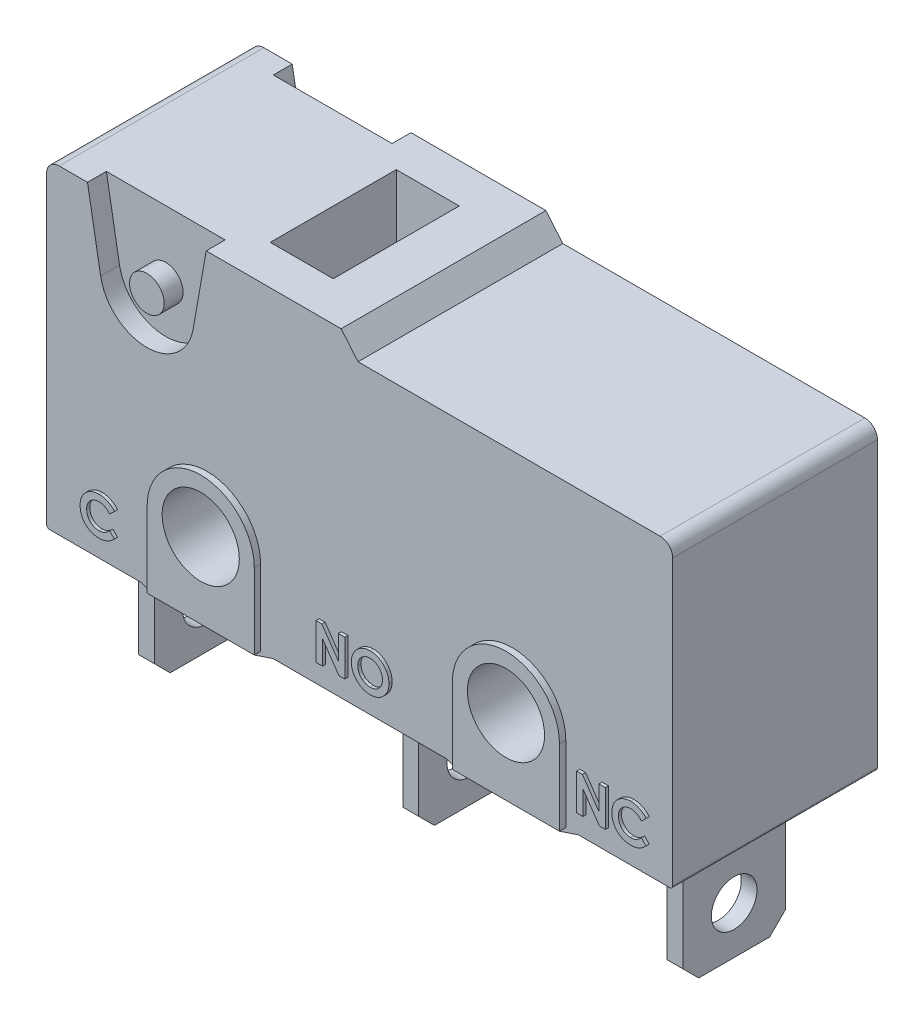
from build123d import *

# Parameters (mm, degrees)
BOSS_EXTRUDE1_DEPTH = 6.5
BOSS_EXTRUDE2_DEPTH = 0.2
SKETCH4_R           = 1.225
CUT_EXTRUDE1_DEPTH  = 10.2
FILLET1_R           = 0.1
SKETCH5_R           = 0.55
CUT_EXTRUDE2_DEPTH  = 0.6
SKETCH6_W           = 2
SKETCH6_H           = 4
CUT_EXTRUDE3_DEPTH  = 2
SKETCH7_W           = 0.5
SKETCH7_H           = 3.25
BOSS_EXTRUDE3_DEPTH = 4.15
CHAMFER1_SIZE       = 0.5
SKETCH8_R           = 0.725
CUT_EXTRUDE4_DEPTH  = 18.15
BOSS_EXTRUDE4_DEPTH = 0.1
BOSS_EXTRUDE5_DEPTH = 0.1
BOSS_EXTRUDE6_DEPTH = 0.1
BOSS_EXTRUDE7_DEPTH = 0.1
BOSS_EXTRUDE8_DEPTH = 0.1
BOSS_EXTRUDE9_DEPTH = 0.1


with BuildPart() as part:
    # Sketch1 → Boss-Extrude1 (new body)
    with BuildSketch(Plane.XY):
        with BuildLine():
            Line((9.352976236, 0), (9.89, -0.64))
            Line((9.89, -0.64), (19.48, -0.64))
            ThreePointArc((19.48, -0.64), (19.762842712, -0.757157288), (19.88, -1.04))
            Line((19.88, -1.04), (19.88, -10.15))
            Line((19.88, -10.15), (16.88, -10.15))
            Line((16.88, -10.15), (16.285, -10.35))
            Line((16.285, -10.35), (13.285, -10.35))
            Line((13.285, -10.35), (12.69, -10.15))
            Line((12.69, -10.15), (7.19, -10.15))
            Line((7.19, -10.15), (6.595, -10.35))
            Line((6.595, -10.35), (3.595, -10.35))
            Line((3.595, -10.35), (3, -10.15))
            Line((3, -10.15), (0, -10.15))
            Line((0, -10.15), (0, -0.4))
            ThreePointArc((0, -0.4), (0.117157288, -0.117157288), (0.4, 0))
            Line((0.4, 0), (9.352976236, 0))
        make_face()
    extrude(amount=BOSS_EXTRUDE1_DEPTH)

    # Sketch3 → Boss-Extrude2 (add)
    with BuildSketch(Plane.XY.offset(6.5)):
        with BuildLine():
            Line((3.395, -7.75), (3.395, -10.15))
            Line((3.395, -10.15), (6.795, -10.15))
            Line((6.795, -10.15), (6.795, -7.75))
            ThreePointArc((6.795, -7.75), (5.095, -6.05), (3.395, -7.75))
        make_face()
        with BuildLine():
            Line((13.085, -7.75), (13.085, -10.15))
            Line((13.085, -10.15), (16.485, -10.15))
            Line((16.485, -10.15), (16.485, -7.75))
            ThreePointArc((16.485, -7.75), (14.785, -6.05), (13.085, -7.75))
        make_face()
    boss_extrude2 = extrude(amount=BOSS_EXTRUDE2_DEPTH)

    # Mirror1: Boss-Extrude2 across plane
    add(boss_extrude2.mirror(Plane.XY.offset(3.25)))

    # Sketch4 → Cut-Extrude1 (cut)
    with BuildSketch(Plane.XY.offset(6.7)):
        with Locations((5.095, -7.75)):
            Circle(SKETCH4_R)
        with Locations((14.785, -7.75)):
            Circle(SKETCH4_R)
    extrude(amount=-CUT_EXTRUDE1_DEPTH, mode=Mode.SUBTRACT)

    # Fillet1
    fillet1_edges = [part.edges().sort_by_distance(p)[0] for p in [
        (0, -10.15, 3.25),
        (19.88, -10.15, 3.25),
    ]]
    fillet(fillet1_edges, radius=FILLET1_R)

    # Sketch5 → Cut-Extrude2 (cut)
    with BuildSketch(Plane.XY.offset(6.5)):
        with BuildLine():
            Line((1.717678208, -2.368770825), (1.3, 0))
            Line((1.3, 0), (5.07, 0))
            Line((5.07, 0), (4.652321792, -2.368770825))
            ThreePointArc((4.652321792, -2.368770825), (3.185, -3.6), (1.717678208, -2.368770825))
        make_face()
        with Locations((3.185, -2.110042404)):
            Circle(SKETCH5_R, mode=Mode.SUBTRACT)
    cut_extrude2 = extrude(amount=-CUT_EXTRUDE2_DEPTH, mode=Mode.SUBTRACT)

    # Mirror2: Cut-Extrude2 across plane
    add(cut_extrude2.mirror(Plane.XY.offset(3.25)), mode=Mode.SUBTRACT)

    # Sketch6 → Cut-Extrude3 (cut)
    with BuildSketch(Plane(origin=(0, 0, 0), x_dir=(1, 0, 0), z_dir=(0, 1, 0))):
        with Locations((6.852976236, -3.25)):
            Rectangle(SKETCH6_W, SKETCH6_H)
    extrude(amount=-CUT_EXTRUDE3_DEPTH, mode=Mode.SUBTRACT)

    # Sketch7 → Boss-Extrude3 (add)
    with BuildSketch(Plane.XZ.offset(10.15)):
        with Locations((1.55, 3.25)):
            Rectangle(SKETCH7_W, SKETCH7_H)
        with Locations((9.94, 3.25)):
            Rectangle(SKETCH7_W, SKETCH7_H)
        with Locations((18.33, 3.25)):
            Rectangle(SKETCH7_W, SKETCH7_H)
    extrude(amount=BOSS_EXTRUDE3_DEPTH)

    # Chamfer1
    chamfer1_edges = [part.edges().sort_by_distance(p)[0] for p in [
        (1.55, -14.3, 1.625),
        (1.55, -14.3, 4.875),
        (9.94, -14.3, 1.625),
        (9.94, -14.3, 4.875),
        (18.33, -14.3, 1.625),
        (18.33, -14.3, 4.875),
    ]]
    chamfer(chamfer1_edges, length=CHAMFER1_SIZE)

    # Sketch8 → Cut-Extrude4 (cut)
    with BuildSketch(Plane.ZY.offset(-1.3)):
        with Locations((3.25, -12.8)):
            Circle(SKETCH8_R)
    extrude(amount=-CUT_EXTRUDE4_DEPTH, mode=Mode.SUBTRACT)

    # Sketch9 → Boss-Extrude4 (add)
    # profile 1 of 5: a face of its own
    with BuildSketch(Plane.XY.offset(6.5)):
        with BuildLine():
            Line((2.257577475, -8.522307291), (2.106225312, -8.666978765))
            add(Edge.make_bspline(
                [(2.106225312, -8.666978765), (2.093386388, -8.653703296), (2.068307948, -8.627772147), (2.027897144, -8.593441591), (1.985871379, -8.564831718), (1.94304818, -8.540736665), (1.898657283, -8.52250704), (1.853211966, -8.509222805), (1.806422049, -8.501123909), (1.774756433, -8.500197252), (1.758829479, -8.499731169)],
                knots=[0, 0, 0, 0, 1.115251505, 2.178435587, 3.19620269, 4.182487026, 5.141301733, 6.088180966, 7.038406374, 8, 8, 8, 8], degree=3))
            add(Edge.make_bspline(
                [(1.758829479, -8.499731169), (1.745528536, -8.500099391), (1.719280592, -8.500826037), (1.680741731, -8.506153071), (1.643877319, -8.515211923), (1.608561163, -8.527696699), (1.574897182, -8.543851336), (1.542814796, -8.563663332), (1.512393102, -8.586953756), (1.484033954, -8.613602102), (1.458092001, -8.642717422), (1.435170634, -8.6737834), (1.415970313, -8.706728863), (1.400212921, -8.741220166), (1.387938523, -8.777416951), (1.37917306, -8.815294849), (1.37410335, -8.85489897), (1.373346662, -8.881821556), (1.372962091, -8.895504406)],
                knots=[0, 0, 0, 0, 1.035432265, 2.043311493, 3.022114605, 3.98653278, 4.95457646, 5.923598177, 6.917315552, 7.932509744, 8.948865224, 9.949768934, 10.933144597, 11.912367597, 12.897413939, 13.903909035, 14.934704909, 16, 16, 16, 16], degree=3))
            add(Edge.make_bspline(
                [(1.372962091, -8.895504406), (1.37307292, -8.905107988), (1.373291366, -8.924036844), (1.375682647, -8.952037877), (1.379533173, -8.979205498), (1.385105838, -9.005498556), (1.392074511, -9.030939838), (1.400250351, -9.055748822), (1.410506821, -9.079582706), (1.421891658, -9.102718305), (1.435132093, -9.124524334), (1.449407724, -9.145318192), (1.464887315, -9.16499795), (1.481671128, -9.183483157), (1.499995375, -9.20048493), (1.519386441, -9.216514532), (1.540171427, -9.231170689), (1.561918577, -9.244821213), (1.584815758, -9.256679539), (1.608241716, -9.267420892), (1.632551637, -9.276144467), (1.657449532, -9.283176464), (1.682846425, -9.289156128), (1.708990721, -9.292837991), (1.735655782, -9.295626222), (1.753676888, -9.295798379), (1.762745745, -9.295885015)],
                knots=[0, 0, 0, 0, 1.103660481, 2.175337485, 3.227646561, 4.255952547, 5.262355991, 6.258840057, 7.255597736, 8.242457506, 9.22035537, 10.185017736, 11.140346927, 12.096287581, 13.051739095, 14.01125915, 14.986044842, 15.97314143, 16.960198552, 17.947847494, 18.933482797, 19.925264591, 20.920966487, 21.929612487, 22.958107872, 24, 24, 24, 24], degree=3))
            add(Edge.make_bspline(
                [(1.762745745, -9.295885015), (1.778128085, -9.295440076), (1.808350382, -9.294565887), (1.85270595, -9.287729851), (1.894972387, -9.276484958), (1.928743068, -9.263205394), (1.955201504, -9.250091651), (1.975343921, -9.237962085), (1.996172749, -9.224393834), (2.017342041, -9.208874817), (2.039089908, -9.191591269), (2.061032451, -9.172164647), (2.083731402, -9.151234643), (2.09860126, -9.136296487), (2.106225312, -9.128637419)],
                knots=[0, 0, 0, 0, 1.404581149, 2.759636711, 4.088442092, 5.392261763, 6.066678138, 6.783632037, 7.538459478, 8.336747902, 9.180226004, 10.074962426, 11.012997595, 12, 12, 12, 12], degree=3))
            Line((2.106225312, -9.128637419), (2.252970104, -9.282754005))
            add(Edge.make_bspline(
                [(2.252970104, -9.282754005), (2.242654735, -9.29271317), (2.22252134, -9.31215133), (2.192150674, -9.339751704), (2.16181823, -9.364553707), (2.132256778, -9.387457546), (2.10298207, -9.407795974), (2.07399721, -9.425589304), (2.04563032, -9.441287555), (2.017292352, -9.454625984), (1.988806972, -9.465951696), (1.959498864, -9.475702391), (1.92927843, -9.483951127), (1.897961098, -9.490606774), (1.865838975, -9.495943705), (1.832611442, -9.499546102), (1.798489178, -9.501967874), (1.775343518, -9.50218549), (1.763667219, -9.502295271)],
                knots=[0, 0, 0, 0, 1.244526981, 2.429050516, 3.560637417, 4.644440555, 5.67424972, 6.652764056, 7.595344123, 8.486817594, 9.369275933, 10.254498637, 11.166417451, 12.086725134, 13.032340136, 13.991389299, 14.986715468, 16, 16, 16, 16], degree=3))
            add(Edge.make_bspline(
                [(1.763667219, -9.502295271), (1.742219304, -9.501748521), (1.700251695, -9.500678683), (1.638749259, -9.492751908), (1.580323596, -9.479462808), (1.524832567, -9.460668356), (1.472293817, -9.436659324), (1.422720786, -9.407225379), (1.376193377, -9.372444721), (1.333087437, -9.332725014), (1.294096064, -9.288857931), (1.259632205, -9.24175672), (1.2311237, -9.191189893), (1.207452473, -9.137904485), (1.188941886, -9.081657334), (1.17591357, -9.022387598), (1.167879103, -8.960152504), (1.167000121, -8.917644501), (1.166551834, -8.895965143)],
                knots=[0, 0, 0, 0, 1.078019885, 2.10938526, 3.111377082, 4.085535484, 5.04941344, 6.010039228, 6.978205633, 7.964457913, 8.951525778, 9.924444315, 10.892603023, 11.863865945, 12.85144698, 13.863884204, 14.910567087, 16, 16, 16, 16], degree=3))
            add(Edge.make_bspline(
                [(1.166551834, -8.895965143), (1.166741259, -8.881826051), (1.167116651, -8.853805826), (1.17106206, -8.812529765), (1.17656219, -8.772292989), (1.185287646, -8.733513288), (1.195805323, -8.695668229), (1.208885436, -8.659169144), (1.224507094, -8.623911129), (1.242166775, -8.589835162), (1.262144995, -8.557164476), (1.28446286, -8.526179764), (1.308545821, -8.496641829), (1.334972553, -8.468942548), (1.36335904, -8.442838715), (1.393833444, -8.418471792), (1.426212477, -8.395492329), (1.460583776, -8.374492912), (1.4962796, -8.355497823), (1.532849729, -8.338743343), (1.570204316, -8.324740456), (1.608185421, -8.313125578), (1.646953515, -8.304455893), (1.68623188, -8.297893221), (1.726354728, -8.294224645), (1.753293744, -8.293624076), (1.766892379, -8.293320912)],
                knots=[0, 0, 0, 0, 1.071919942, 2.124283339, 3.142214191, 4.149696895, 5.136002878, 6.119640489, 7.086990633, 8.058538607, 9.028339693, 9.988281803, 10.952401235, 11.916291999, 12.888973767, 13.874849856, 14.873389453, 15.898127285, 16.927174885, 17.938320013, 18.946391617, 19.950418109, 20.947802303, 21.956882652, 22.968648068, 24, 24, 24, 24], degree=3))
            add(Edge.make_bspline(
                [(1.766892379, -8.293320912), (1.778493409, -8.293494693), (1.80157485, -8.293840448), (1.83594699, -8.29672269), (1.870044237, -8.301249221), (1.903744513, -8.308078794), (1.937288877, -8.316186359), (1.970236519, -8.326802098), (2.003107205, -8.338635339), (2.035385407, -8.352779563), (2.067116181, -8.368219261), (2.097556184, -8.385736159), (2.1272165, -8.404252286), (2.155439875, -8.424863509), (2.182754994, -8.44682222), (2.209019022, -8.470230868), (2.234001478, -8.495479745), (2.249679081, -8.513319567), (2.257577475, -8.522307291)],
                knots=[0, 0, 0, 0, 0.996412454, 1.982464992, 2.961075852, 3.949442424, 4.934965278, 5.923860011, 6.921385422, 7.934793307, 8.949617135, 9.951082467, 10.950285876, 11.951772932, 12.951063433, 13.960125323, 14.972308753, 16, 16, 16, 16], degree=3))
        make_face()
    # profile 2 of 5: a face of its own
    with BuildSketch(Plane.XY.offset(6.5)):
        Polygon((8.656295424, -8.322808092), (8.842202876, -8.322808092), (9.363987732, -9.079568909), (9.363987732, -8.322808092), (9.570397988, -8.322808092), (9.570397988, -9.472808092), (9.383108325, -9.472808092), (8.862705681, -8.71835096), (8.862705681, -9.472808092), (8.656295424, -9.472808092), align=None)
    # profile 3 of 5: a face of its own
    with BuildSketch(Plane.XY.offset(6.5)):
        with BuildLine():
            add(Edge.make_bspline(
                [(10.376227315, -8.293320912), (10.396221475, -8.293838597), (10.435694474, -8.294860624), (10.493745011, -8.303380013), (10.549687438, -8.317261137), (10.603496456, -8.336556904), (10.655037335, -8.36178994), (10.704491876, -8.392244873), (10.751682935, -8.428496522), (10.796126936, -8.469699194), (10.837201209, -8.514505302), (10.872792091, -8.562747042), (10.903142689, -8.613174423), (10.928297346, -8.665922568), (10.947457299, -8.721356781), (10.960902631, -8.779194422), (10.96954059, -8.839419036), (10.970534089, -8.880423789), (10.971039014, -8.901263621)],
                knots=[0, 0, 0, 0, 1.014329547, 2.002516266, 2.970391464, 3.935626869, 4.897733899, 5.877609409, 6.878433252, 7.912639331, 8.949961323, 9.958554974, 10.949718813, 11.932905612, 12.9188844, 13.919928257, 14.942845884, 16, 16, 16, 16], degree=3))
            add(Edge.make_bspline(
                [(10.971039014, -8.901263621), (10.97050129, -8.921868635), (10.969441689, -8.962471477), (10.96125527, -9.022141098), (10.947583517, -9.079359177), (10.928748532, -9.134255229), (10.904050085, -9.186563356), (10.874291357, -9.236617539), (10.83868707, -9.283953263), (10.798535854, -9.328545125), (10.754332849, -9.369021808), (10.70751485, -9.404691815), (10.658298033, -9.434917233), (10.606754435, -9.459684217), (10.552773525, -9.478904961), (10.496488642, -9.492466593), (10.437903268, -9.500708271), (10.398062372, -9.501760951), (10.377839895, -9.502295271)],
                knots=[0, 0, 0, 0, 1.051557043, 2.072126891, 3.067553643, 4.050577992, 5.02905126, 6.015227836, 7.017913613, 8.04756643, 9.074058332, 10.072836633, 11.047628519, 12.017157415, 12.98668631, 13.966869689, 14.968021931, 16, 16, 16, 16], degree=3))
            add(Edge.make_bspline(
                [(10.377839895, -9.502295271), (10.356689609, -9.50181596), (10.315132189, -9.500874178), (10.254312717, -9.49191826), (10.196042409, -9.47842752), (10.140810767, -9.458293315), (10.088055304, -9.433123865), (10.038163631, -9.402126179), (9.991152515, -9.365351481), (9.947291618, -9.323741587), (9.907553539, -9.278211237), (9.87247689, -9.230112459), (9.842888959, -9.179812686), (9.818788662, -9.127288378), (9.799788956, -9.072865958), (9.786386823, -9.01621398), (9.778469862, -8.957468316), (9.777367076, -8.917567086), (9.776808245, -8.897347355)],
                knots=[0, 0, 0, 0, 1.067978421, 2.098431617, 3.099715153, 4.085208694, 5.062210972, 6.048429807, 7.046490867, 8.072918869, 9.098532598, 10.095778865, 11.076610158, 12.041847152, 13.011192615, 13.984257998, 14.978533688, 16, 16, 16, 16], degree=3))
            add(Edge.make_bspline(
                [(9.776808245, -8.897347355), (9.776983638, -8.883744578), (9.777332204, -8.856711267), (9.781531048, -8.816649279), (9.787576175, -8.777369248), (9.796516632, -8.739027783), (9.807377002, -8.701354403), (9.821448145, -8.664699782), (9.837464914, -8.628672346), (9.856179001, -8.593697626), (9.876987255, -8.560097417), (9.899690914, -8.528030218), (9.924347065, -8.497883769), (9.950876281, -8.469459958), (9.979369987, -8.442945619), (10.009453378, -8.417965403), (10.041709895, -8.395182874), (10.075433545, -8.374041637), (10.110434202, -8.354923983), (10.146569381, -8.338651607), (10.183094626, -8.324441219), (10.220497866, -8.313225752), (10.258378257, -8.304090872), (10.297140476, -8.298049819), (10.336434327, -8.293851092), (10.362931507, -8.293498058), (10.376227315, -8.293320912)],
                knots=[0, 0, 0, 0, 1.034744296, 2.056386356, 3.06226378, 4.057406941, 5.050368692, 6.043467995, 7.042652155, 8.049140477, 9.059438543, 10.048523776, 11.036952808, 12.020949711, 13.004946614, 13.997082645, 14.994316842, 16.007702937, 17.024872941, 18.026463647, 19.021641123, 20.005082605, 20.995858141, 21.984425357, 22.988620895, 24, 24, 24, 24], degree=3))
        make_face()
        with BuildLine():
            add(Edge.make_bspline(
                [(10.373002155, -8.499731169), (10.359546088, -8.500092225), (10.332989197, -8.500804806), (10.294035075, -8.50623371), (10.256637742, -8.514904286), (10.221004506, -8.527463509), (10.18698093, -8.543448213), (10.154506701, -8.562802545), (10.124031519, -8.586191788), (10.095149028, -8.612360278), (10.069058449, -8.64151799), (10.0460066, -8.672765438), (10.026715916, -8.706050438), (10.010559847, -8.74106378), (9.998397907, -8.778199182), (9.989735322, -8.817165756), (9.984260892, -8.858030644), (9.983570833, -8.885888185), (9.983218501, -8.900111778)],
                knots=[0, 0, 0, 0, 1.033739768, 2.040188636, 3.016340934, 3.979330865, 4.937572243, 5.900995986, 6.878200029, 7.884839167, 8.891893314, 9.879764717, 10.863503415, 11.843163062, 12.837761627, 13.859916423, 14.907309254, 16, 16, 16, 16], degree=3))
            add(Edge.make_bspline(
                [(9.983218501, -8.900111778), (9.98368564, -8.915874718), (9.984601155, -8.946767469), (9.99104283, -8.991832983), (10.002063894, -9.034392887), (10.017978097, -9.074239029), (10.037715884, -9.11181387), (10.062227082, -9.146656876), (10.091114727, -9.178976671), (10.113369534, -9.197846314), (10.124664815, -9.207423476)],
                knots=[0, 0, 0, 0, 1.078454662, 2.113592447, 3.107694534, 4.079536787, 5.043276885, 6.005368276, 6.987637804, 8, 8, 8, 8], degree=3))
            add(Edge.make_bspline(
                [(10.124664815, -9.207423476), (10.133917807, -9.214498717), (10.152215318, -9.22848979), (10.18142213, -9.246422222), (10.211499396, -9.261792104), (10.242674085, -9.274210787), (10.274880359, -9.283979115), (10.308113801, -9.290819714), (10.342327323, -9.295112782), (10.365464109, -9.295625885), (10.37714879, -9.295885015)],
                knots=[0, 0, 0, 0, 1.023928204, 2.024787132, 3.009472467, 3.9914905, 4.972207045, 5.96565515, 6.972602802, 8, 8, 8, 8], degree=3))
            add(Edge.make_bspline(
                [(10.37714879, -9.295885015), (10.390373479, -9.295520897), (10.416393471, -9.294804484), (10.454622441, -9.289442413), (10.491246956, -9.280367853), (10.526494383, -9.267918804), (10.560263085, -9.251733398), (10.592388025, -9.231778756), (10.622925526, -9.208299894), (10.651771221, -9.181787754), (10.67813755, -9.152515181), (10.701141295, -9.121101063), (10.721045327, -9.088237547), (10.73686543, -9.0534595), (10.74950786, -9.017095211), (10.758066187, -8.978983631), (10.763586863, -8.939281868), (10.764277116, -8.912263416), (10.764628757, -8.898499198)],
                knots=[0, 0, 0, 0, 1.026359118, 2.019393844, 2.989460624, 3.950973911, 4.916101784, 5.890408035, 6.881132271, 7.902007068, 8.92769091, 9.933912415, 10.920395702, 11.90457117, 12.894218921, 13.903490204, 14.931958862, 16, 16, 16, 16], degree=3))
            add(Edge.make_bspline(
                [(10.764628757, -8.898499198), (10.76426495, -8.884814127), (10.763548849, -8.857877154), (10.758177341, -8.818277464), (10.74916033, -8.780334135), (10.736673897, -8.7439852), (10.720729384, -8.709195024), (10.701012376, -8.676085951), (10.677592058, -8.644689987), (10.651007446, -8.615221086), (10.62207173, -8.588141053), (10.591006348, -8.564640507), (10.558680544, -8.54421928), (10.524352606, -8.528222115), (10.488724855, -8.515477208), (10.451579888, -8.506091675), (10.412777018, -8.500842945), (10.386378623, -8.500105064), (10.373002155, -8.499731169)],
                knots=[0, 0, 0, 0, 1.055025985, 2.07665775, 3.074803781, 4.057872707, 5.035505728, 6.020516407, 7.023567878, 8.050795229, 9.077271434, 10.074415901, 11.050397877, 12.019801805, 12.988065821, 13.964604439, 14.968634123, 16, 16, 16, 16], degree=3))
        make_face(mode=Mode.SUBTRACT)
    # profile 4 of 5: a face of its own
    with BuildSketch(Plane.XY.offset(6.5)):
        Polygon((16.92744927, -8.322808092), (17.113356722, -8.322808092), (17.635141578, -9.079568909), (17.635141578, -8.322808092), (17.841551834, -8.322808092), (17.841551834, -9.472808092), (17.654262171, -9.472808092), (17.133859527, -8.71835096), (17.133859527, -9.472808092), (16.92744927, -9.472808092), align=None)
    # profile 5 of 5: a face of its own
    with BuildSketch(Plane.XY.offset(6.5)):
        with BuildLine():
            Line((19.138987732, -8.522307291), (18.987635568, -8.666978765))
            add(Edge.make_bspline(
                [(18.987635568, -8.666978765), (18.974796645, -8.653703296), (18.949718205, -8.627772147), (18.9093074, -8.593441591), (18.867281635, -8.564831718), (18.824458436, -8.540736665), (18.780067539, -8.52250704), (18.734622223, -8.509222805), (18.687832306, -8.501123909), (18.656166689, -8.500197252), (18.640239735, -8.499731169)],
                knots=[0, 0, 0, 0, 1.115251505, 2.178435587, 3.19620269, 4.182487026, 5.141301733, 6.088180966, 7.038406374, 8, 8, 8, 8], degree=3))
            add(Edge.make_bspline(
                [(18.640239735, -8.499731169), (18.626938793, -8.500099391), (18.600690848, -8.500826037), (18.562151987, -8.506153071), (18.525287575, -8.515211923), (18.489971419, -8.527696699), (18.456307438, -8.543851336), (18.424225052, -8.563663332), (18.393803358, -8.586953756), (18.36544421, -8.613602102), (18.339502258, -8.642717422), (18.316580891, -8.6737834), (18.297380569, -8.706728863), (18.281623178, -8.741220166), (18.269348779, -8.777416951), (18.260583316, -8.815294849), (18.255513606, -8.85489897), (18.254756918, -8.881821556), (18.254372347, -8.895504406)],
                knots=[0, 0, 0, 0, 1.035432265, 2.043311493, 3.022114605, 3.98653278, 4.95457646, 5.923598177, 6.917315552, 7.932509744, 8.948865224, 9.949768934, 10.933144597, 11.912367597, 12.897413939, 13.903909035, 14.934704909, 16, 16, 16, 16], degree=3))
            add(Edge.make_bspline(
                [(18.254372347, -8.895504406), (18.254483176, -8.905107988), (18.254701623, -8.924036844), (18.257092903, -8.952037877), (18.260943429, -8.979205498), (18.266516095, -9.005498556), (18.273484767, -9.030939838), (18.281660607, -9.055748822), (18.291917078, -9.079582706), (18.303301915, -9.102718305), (18.316542349, -9.124524334), (18.33081798, -9.145318192), (18.346297571, -9.16499795), (18.363081384, -9.183483157), (18.381405631, -9.20048493), (18.400796697, -9.216514532), (18.421581684, -9.231170689), (18.443328834, -9.244821213), (18.466226014, -9.256679539), (18.489651973, -9.267420892), (18.513961893, -9.276144467), (18.538859788, -9.283176464), (18.564256681, -9.289156128), (18.590400977, -9.292837991), (18.617066039, -9.295626222), (18.635087144, -9.295798379), (18.644156001, -9.295885015)],
                knots=[0, 0, 0, 0, 1.103660481, 2.175337485, 3.227646561, 4.255952547, 5.262355991, 6.258840057, 7.255597736, 8.242457506, 9.22035537, 10.185017736, 11.140346927, 12.096287581, 13.051739095, 14.01125915, 14.986044842, 15.97314143, 16.960198552, 17.947847494, 18.933482797, 19.925264591, 20.920966487, 21.929612487, 22.958107872, 24, 24, 24, 24], degree=3))
            add(Edge.make_bspline(
                [(18.644156001, -9.295885015), (18.659538341, -9.295440076), (18.689760639, -9.294565887), (18.734116206, -9.287729851), (18.776382643, -9.276484958), (18.810153324, -9.263205394), (18.836611761, -9.250091651), (18.856754177, -9.237962085), (18.877583006, -9.224393834), (18.898752298, -9.208874817), (18.920500165, -9.191591269), (18.942442708, -9.172164647), (18.965141659, -9.151234643), (18.980011517, -9.136296487), (18.987635568, -9.128637419)],
                knots=[0, 0, 0, 0, 1.404581149, 2.759636711, 4.088442092, 5.392261763, 6.066678138, 6.783632037, 7.538459478, 8.336747902, 9.180226004, 10.074962426, 11.012997595, 12, 12, 12, 12], degree=3))
            Line((18.987635568, -9.128637419), (19.13438036, -9.282754005))
            add(Edge.make_bspline(
                [(19.13438036, -9.282754005), (19.124064991, -9.29271317), (19.103931597, -9.31215133), (19.07356093, -9.339751704), (19.043228487, -9.364553707), (19.013667035, -9.387457546), (18.984392326, -9.407795974), (18.955407466, -9.425589304), (18.927040576, -9.441287555), (18.898702608, -9.454625984), (18.870217229, -9.465951696), (18.840909121, -9.475702391), (18.810688687, -9.483951127), (18.779371354, -9.490606774), (18.747249232, -9.495943705), (18.714021699, -9.499546102), (18.679899435, -9.501967874), (18.656753775, -9.50218549), (18.645077475, -9.502295271)],
                knots=[0, 0, 0, 0, 1.244526981, 2.429050516, 3.560637417, 4.644440555, 5.67424972, 6.652764056, 7.595344123, 8.486817594, 9.369275933, 10.254498637, 11.166417451, 12.086725134, 13.032340136, 13.991389299, 14.986715468, 16, 16, 16, 16], degree=3))
            add(Edge.make_bspline(
                [(18.645077475, -9.502295271), (18.62362956, -9.501748521), (18.581661952, -9.500678683), (18.520159516, -9.492751908), (18.461733853, -9.479462808), (18.406242823, -9.460668356), (18.353704073, -9.436659324), (18.304131043, -9.407225379), (18.257603633, -9.372444721), (18.214497694, -9.332725014), (18.17550632, -9.288857931), (18.141042461, -9.24175672), (18.112533956, -9.191189893), (18.08886273, -9.137904485), (18.070352142, -9.081657334), (18.057323827, -9.022387598), (18.04928936, -8.960152504), (18.048410377, -8.917644501), (18.047962091, -8.895965143)],
                knots=[0, 0, 0, 0, 1.078019885, 2.10938526, 3.111377082, 4.085535484, 5.04941344, 6.010039228, 6.978205633, 7.964457913, 8.951525778, 9.924444315, 10.892603023, 11.863865945, 12.85144698, 13.863884204, 14.910567087, 16, 16, 16, 16], degree=3))
            add(Edge.make_bspline(
                [(18.047962091, -8.895965143), (18.048151515, -8.881826051), (18.048526907, -8.853805826), (18.052472317, -8.812529765), (18.057972447, -8.772292989), (18.066697903, -8.733513288), (18.077215579, -8.695668229), (18.090295692, -8.659169144), (18.10591735, -8.623911129), (18.123577031, -8.589835162), (18.143555251, -8.557164476), (18.165873116, -8.526179764), (18.189956078, -8.496641829), (18.216382809, -8.468942548), (18.244769296, -8.442838715), (18.2752437, -8.418471792), (18.307622733, -8.395492329), (18.341994033, -8.374492912), (18.377689856, -8.355497823), (18.414259986, -8.338743343), (18.451614572, -8.324740456), (18.489595677, -8.313125578), (18.528363771, -8.304455893), (18.567642136, -8.297893221), (18.607764984, -8.294224645), (18.634704001, -8.293624076), (18.648302636, -8.293320912)],
                knots=[0, 0, 0, 0, 1.071919942, 2.124283339, 3.142214191, 4.149696895, 5.136002878, 6.119640489, 7.086990633, 8.058538607, 9.028339693, 9.988281803, 10.952401235, 11.916291999, 12.888973767, 13.874849856, 14.873389453, 15.898127285, 16.927174885, 17.938320013, 18.946391617, 19.950418109, 20.947802303, 21.956882652, 22.968648068, 24, 24, 24, 24], degree=3))
            add(Edge.make_bspline(
                [(18.648302636, -8.293320912), (18.659903666, -8.293494693), (18.682985107, -8.293840448), (18.717357246, -8.29672269), (18.751454493, -8.301249221), (18.78515477, -8.308078794), (18.818699134, -8.316186359), (18.851646775, -8.326802098), (18.884517461, -8.338635339), (18.916795663, -8.352779563), (18.948526438, -8.368219261), (18.97896644, -8.385736159), (19.008626757, -8.404252286), (19.036850132, -8.424863509), (19.06416525, -8.44682222), (19.090429279, -8.470230868), (19.115411735, -8.495479745), (19.131089337, -8.513319567), (19.138987732, -8.522307291)],
                knots=[0, 0, 0, 0, 0.996412454, 1.982464992, 2.961075852, 3.949442424, 4.934965278, 5.923860011, 6.921385422, 7.934793307, 8.949617135, 9.951082467, 10.950285876, 11.951772932, 12.951063433, 13.960125323, 14.972308753, 16, 16, 16, 16], degree=3))
        make_face()
    extrude(amount=BOSS_EXTRUDE4_DEPTH)

    # Sketch11 → Boss-Extrude5 (add)
    with BuildSketch(Plane(origin=(0, 0, 0), x_dir=(-1, 0, 0), z_dir=(0, 0, -1))):
        Polygon((-18.832232526, -0.929337472), (-18.672488937, -0.929337472), (-18.672488937, -1.607178016), (-17.930465699, -0.929337472), (-17.702617142, -0.929337472), (-18.57728461, -1.72805542), (-17.634155603, -2.709337472), (-17.847028199, -2.709337472), (-18.672488937, -1.850359106), (-18.672488937, -2.709337472), (-18.832232526, -2.709337472), align=None)
        Polygon((-17.48582227, -0.929337472), (-17.320730122, -0.929337472), (-16.972360731, -2.234742119), (-16.454263776, -0.929337472), (-16.431086693, -0.929337472), (-15.922617142, -2.225827856), (-15.572464898, -0.929337472), (-15.409155603, -0.929337472), (-15.889099514, -2.709337472), (-15.911920026, -2.709337472), (-16.447488937, -1.347951254), (-16.989476116, -2.709337472), (-17.012296629, -2.709337472), align=None)
        with BuildLine():
            Line((-8.654283808, -1.255956061), (-8.794059449, -1.362927215))
            add(Edge.make_bspline(
                [(-8.794059449, -1.362927215), (-8.804030444, -1.351043951), (-8.823838003, -1.327437633), (-8.855704683, -1.294289179), (-8.888915233, -1.263233132), (-8.923456957, -1.234121548), (-8.959951595, -1.20797245), (-8.997515087, -1.183423146), (-9.036775807, -1.161418411), (-9.091066689, -1.134737235), (-9.162087595, -1.106894904), (-9.251491827, -1.083549833), (-9.344820329, -1.068688777), (-9.408492251, -1.06707923), (-9.44087836, -1.066260548)],
                knots=[0, 0, 0, 0, 0.757959112, 1.505699292, 2.245454638, 2.979532153, 3.711538275, 4.438200793, 5.171680507, 5.909471876, 7.393775596, 8.890124382, 10.418191784, 12, 12, 12, 12], degree=3))
            add(Edge.make_bspline(
                [(-9.44087836, -1.066260548), (-9.458720723, -1.066465992), (-9.494239857, -1.066874973), (-9.546952509, -1.072270471), (-9.598680861, -1.079853887), (-9.649391263, -1.091106194), (-9.699019168, -1.105332269), (-9.747889018, -1.122331479), (-9.795293266, -1.143363369), (-9.841887684, -1.166609284), (-9.886529683, -1.192865527), (-9.928769108, -1.221504889), (-9.968451903, -1.252206887), (-10.00560946, -1.285086592), (-10.040279765, -1.319995932), (-10.072211597, -1.35730694), (-10.101294463, -1.396900331), (-10.128104836, -1.438254007), (-10.152115883, -1.481247513), (-10.17221965, -1.526039977), (-10.190022255, -1.57186435), (-10.204109299, -1.619238368), (-10.215259481, -1.667828689), (-10.222952979, -1.717765719), (-10.228287116, -1.768945133), (-10.228694063, -1.80363444), (-10.228899193, -1.821120324)],
                knots=[0, 0, 0, 0, 1.054917814, 2.100044995, 3.131103042, 4.146048494, 5.169673617, 6.183595914, 7.203665975, 8.234915748, 9.262203917, 10.264457458, 11.251630812, 12.227803204, 13.197192746, 14.159520551, 15.12972552, 16.100847026, 17.073214652, 18.039054194, 19.002613845, 19.979014051, 20.95965708, 21.949030935, 22.966165397, 24, 24, 24, 24], degree=3))
            add(Edge.make_bspline(
                [(-10.228899193, -1.821120324), (-10.228257468, -1.847429395), (-10.226997526, -1.899083767), (-10.215784373, -1.974744249), (-10.198744641, -2.047226192), (-10.173206433, -2.116076512), (-10.141716173, -2.182144191), (-10.101925234, -2.244311379), (-10.055840252, -2.303517518), (-10.002809261, -2.35836336), (-9.944625732, -2.408464626), (-9.882199651, -2.452583493), (-9.815686499, -2.489360776), (-9.74582067, -2.519964543), (-9.672064532, -2.543489393), (-9.594550718, -2.560050576), (-9.513447818, -2.570853742), (-9.458029095, -2.571888018), (-9.429824674, -2.572414395)],
                knots=[0, 0, 0, 0, 1.029171465, 2.020641659, 2.987623507, 3.938342917, 4.889210282, 5.84687017, 6.821220943, 7.821438502, 8.827599549, 9.822697543, 10.807740252, 11.797342354, 12.80366471, 13.83203677, 14.896651826, 16, 16, 16, 16], degree=3))
            add(Edge.make_bspline(
                [(-9.429824674, -2.572414395), (-9.398749592, -2.57155553), (-9.337586397, -2.569865077), (-9.247890658, -2.555544088), (-9.162025611, -2.532323775), (-9.079986639, -2.499827118), (-9.002005019, -2.457582486), (-8.927958717, -2.406370422), (-8.857785233, -2.345703784), (-8.815588409, -2.299381508), (-8.794059449, -2.275747728)],
                knots=[0, 0, 0, 0, 1.028121516, 2.023589091, 2.998037872, 3.967518031, 4.937445131, 5.927275754, 6.942489185, 8, 8, 8, 8], degree=3))
            Line((-8.794059449, -2.275747728), (-8.654283808, -2.38164917))
            add(Edge.make_bspline(
                [(-8.654283808, -2.38164917), (-8.665532447, -2.396163012), (-8.687975844, -2.425121174), (-8.72431735, -2.465945072), (-8.762601233, -2.504344267), (-8.803111851, -2.540009171), (-8.845383185, -2.573653442), (-8.890174247, -2.604321231), (-8.936896212, -2.632440595), (-8.985390775, -2.658188002), (-9.035606413, -2.681031631), (-9.087482954, -2.700588118), (-9.140796789, -2.717434491), (-9.195550357, -2.731294047), (-9.251857227, -2.742111913), (-9.309514211, -2.749343633), (-9.368645748, -2.754298092), (-9.408538813, -2.754749661), (-9.428754962, -2.754978497)],
                knots=[0, 0, 0, 0, 0.986787822, 1.968848986, 2.935600012, 3.899624008, 4.868462664, 5.837806735, 6.815139263, 7.798259679, 8.787526145, 9.778297419, 10.776456485, 11.791383307, 12.812564526, 13.85620153, 14.913611965, 16, 16, 16, 16], degree=3))
            add(Edge.make_bspline(
                [(-9.428754962, -2.754978497), (-9.447899456, -2.754845255), (-9.485755321, -2.754581786), (-9.541646686, -2.750313769), (-9.59605853, -2.74449076), (-9.64883534, -2.735722922), (-9.700265121, -2.725376372), (-9.749881647, -2.71150699), (-9.798173154, -2.695970557), (-9.844945625, -2.677710306), (-9.890238843, -2.657104934), (-9.933906725, -2.633816655), (-9.975929184, -2.608041307), (-10.01671937, -2.580347044), (-10.055674712, -2.549844302), (-10.093132791, -2.5169567), (-10.12930365, -2.481795083), (-10.151682159, -2.456440329), (-10.162933648, -2.44369244)],
                knots=[0, 0, 0, 0, 1.114604814, 2.203992996, 3.262667896, 4.300477797, 5.318619304, 6.316056647, 7.298880507, 8.271930387, 9.238335007, 10.195173496, 11.151986948, 12.108099108, 13.064862484, 14.031167946, 15.010108607, 16, 16, 16, 16], degree=3))
            add(Edge.make_bspline(
                [(-10.162933648, -2.44369244), (-10.180955204, -2.421548635), (-10.216780744, -2.377528365), (-10.262616091, -2.306182923), (-10.301851134, -2.231693377), (-10.333573745, -2.153668385), (-10.358373078, -2.072283028), (-10.375553228, -1.98749628), (-10.386717187, -1.899387327), (-10.387993848, -1.839458903), (-10.388642783, -1.808996927)],
                knots=[0, 0, 0, 0, 0.994628077, 1.977248131, 2.950237994, 3.925870899, 4.908910175, 5.911660606, 6.938484602, 8, 8, 8, 8], degree=3))
            add(Edge.make_bspline(
                [(-10.388642783, -1.808996927), (-10.387851856, -1.776979582), (-10.386295756, -1.713987454), (-10.373075037, -1.621542415), (-10.351807192, -1.53297399), (-10.321599632, -1.448447514), (-10.283301482, -1.3675184), (-10.235990804, -1.290804873), (-10.180217229, -1.217816329), (-10.11641818, -1.149660255), (-10.046455364, -1.087340242), (-9.971533224, -1.032513087), (-9.891798405, -0.986885322), (-9.808129327, -0.948744416), (-9.719899466, -0.919428089), (-9.627297067, -0.898905611), (-9.530496133, -0.886131764), (-9.464451813, -0.884516944), (-9.430894385, -0.883696446)],
                knots=[0, 0, 0, 0, 1.032925535, 2.032216505, 3.007276963, 3.968222605, 4.92396291, 5.891752235, 6.871517503, 7.883894988, 8.900124299, 9.891468569, 10.874487609, 11.85992873, 12.854644235, 13.869047385, 14.917252991, 16, 16, 16, 16], degree=3))
            add(Edge.make_bspline(
                [(-9.430894385, -0.883696446), (-9.410442454, -0.883941648), (-9.369959915, -0.884427), (-9.310074281, -0.889159838), (-9.251770469, -0.897049615), (-9.195008312, -0.907788644), (-9.139511667, -0.921116939), (-9.085704688, -0.93847972), (-9.033271641, -0.958332584), (-8.982543214, -0.981197175), (-8.933762797, -1.006863118), (-8.886945583, -1.035045921), (-8.842463455, -1.065710645), (-8.800003412, -1.098596488), (-8.760275739, -1.134399184), (-8.722152473, -1.172133962), (-8.686928267, -1.212887735), (-8.665185214, -1.241573673), (-8.654283808, -1.255956061)],
                knots=[0, 0, 0, 0, 1.096760587, 2.17092713, 3.219439832, 4.250915756, 5.268269357, 6.278326846, 7.281116186, 8.274029601, 9.260640565, 10.235837813, 11.203064059, 12.156899882, 13.114053108, 14.069676657, 15.032185724, 16, 16, 16, 16], degree=3))
        make_face()
        Polygon((-8.289155603, -0.929337472), (-7.285053039, -0.929337472), (-7.285053039, -1.111901574), (-8.129412014, -1.111901574), (-8.129412014, -1.659593882), (-7.285053039, -1.659593882), (-7.285053039, -1.842157984), (-8.129412014, -1.842157984), (-8.129412014, -2.526773369), (-7.285053039, -2.526773369), (-7.285053039, -2.709337472), (-8.289155603, -2.709337472), align=None)
    extrude(amount=BOSS_EXTRUDE5_DEPTH)

    # Sketch12 → Boss-Extrude6 (add)
    # profile 1 of 9: a face of its own
    with BuildSketch(Plane(origin=(0, 0, 0), x_dir=(-1, 0, 0), z_dir=(0, 0, -1))):
        with BuildLine():
            Line((-16.960802951, -3.223041769), (-16.960802951, -3.356375102))
            Line((-16.960802951, -3.356375102), (-17.402990451, -3.356375102))
            Line((-17.402990451, -3.356375102), (-17.473042535, -3.698302186))
            add(Edge.make_bspline(
                [(-17.473042535, -3.698302186), (-17.459278924, -3.69450237), (-17.432614106, -3.687140829), (-17.393257586, -3.678967258), (-17.355894768, -3.674040093), (-17.33164963, -3.67336732), (-17.319917535, -3.673041769)],
                knots=[0, 0, 0, 0, 1.100273476, 2.13160584, 3.095893838, 4, 4, 4, 4], degree=3))
            add(Edge.make_bspline(
                [(-17.319917535, -3.673041769), (-17.305400717, -3.673355974), (-17.276857027, -3.673973779), (-17.235093989, -3.67990618), (-17.195227486, -3.689243862), (-17.157340891, -3.702288628), (-17.121364115, -3.718969386), (-17.087628164, -3.739806506), (-17.055626653, -3.764147458), (-17.02593369, -3.792132748), (-16.99899609, -3.822932206), (-16.975311579, -3.856047986), (-16.955194046, -3.891158261), (-16.939014337, -3.928598487), (-16.926094441, -3.967954744), (-16.917495129, -4.009641132), (-16.911768923, -4.053264719), (-16.911129179, -4.083092131), (-16.910802951, -4.098302186)],
                knots=[0, 0, 0, 0, 1.052922333, 2.070308379, 3.05430497, 4.020497103, 4.973039431, 5.925935799, 6.892292201, 7.88610001, 8.88166317, 9.857072816, 10.836096531, 11.812156883, 12.81219415, 13.836441305, 14.89672472, 16, 16, 16, 16], degree=3))
            add(Edge.make_bspline(
                [(-16.910802951, -4.098302186), (-16.911049979, -4.108896153), (-16.911540697, -4.12994092), (-16.914036172, -4.16119448), (-16.918840867, -4.19178639), (-16.925291736, -4.221720707), (-16.933664634, -4.250940759), (-16.943800568, -4.279530184), (-16.956204807, -4.307311038), (-16.969810746, -4.334546185), (-16.985130867, -4.360619916), (-17.002134312, -4.385003825), (-17.020098638, -4.408063701), (-17.039428295, -4.429552231), (-17.06030295, -4.449328209), (-17.082469795, -4.467508999), (-17.105751948, -4.484402064), (-17.13050961, -4.49932168), (-17.156191103, -4.513050778), (-17.183167298, -4.524313806), (-17.21082413, -4.534383431), (-17.239559655, -4.542409827), (-17.269308785, -4.548699061), (-17.300120559, -4.552970713), (-17.331833379, -4.556081961), (-17.353329813, -4.556276722), (-17.364188368, -4.556375102)],
                knots=[0, 0, 0, 0, 1.056347294, 2.098418968, 3.122841568, 4.141288669, 5.149314143, 6.15115421, 7.162517403, 8.180376062, 9.185164535, 10.17417709, 11.141909838, 12.097768115, 13.052685741, 14.0056014, 14.954263652, 15.917497458, 16.885230207, 17.854509472, 18.828990115, 19.81800267, 20.826176721, 21.857883937, 22.917946725, 24, 24, 24, 24], degree=3))
            add(Edge.make_bspline(
                [(-17.364188368, -4.556375102), (-17.377141635, -4.556118505), (-17.402625658, -4.555613681), (-17.439961869, -4.55033253), (-17.475884436, -4.542768789), (-17.510104188, -4.531389603), (-17.542927801, -4.517131465), (-17.573913381, -4.499111173), (-17.60385267, -4.478690363), (-17.631528569, -4.454591946), (-17.657215125, -4.428251836), (-17.680208972, -4.399667569), (-17.700687157, -4.369310919), (-17.718321749, -4.337034462), (-17.733363871, -4.302923007), (-17.745180867, -4.26684875), (-17.754718542, -4.229000177), (-17.758753526, -4.202943159), (-17.760802951, -4.189708436)],
                knots=[0, 0, 0, 0, 1.0467383, 2.05933395, 3.04377827, 4.011590433, 4.970194871, 5.932262533, 6.905835911, 7.896367577, 8.894135286, 9.877477877, 10.858688626, 11.851381753, 12.8477658, 13.868841284, 14.917554742, 16, 16, 16, 16], degree=3))
            Line((-17.760802951, -4.189708436), (-17.644136285, -4.189708436))
            add(Edge.make_bspline(
                [(-17.644136285, -4.189708436), (-17.641265678, -4.202105404), (-17.635748212, -4.225933065), (-17.623637505, -4.25941042), (-17.60883018, -4.289243275), (-17.59122285, -4.315826263), (-17.570218553, -4.339006747), (-17.54625048, -4.359664513), (-17.519378468, -4.37830099), (-17.489518126, -4.393835161), (-17.458016125, -4.407083555), (-17.425045447, -4.415905613), (-17.391503833, -4.422108802), (-17.368817581, -4.422729741), (-17.357417535, -4.423041769)],
                knots=[0, 0, 0, 0, 1.136247022, 2.183929868, 3.172523383, 4.106158343, 5.02341133, 5.958108904, 6.928429099, 7.938127109, 8.96079061, 9.975095812, 10.982467395, 12, 12, 12, 12], degree=3))
            add(Edge.make_bspline(
                [(-17.357417535, -4.423041769), (-17.346290113, -4.422736909), (-17.324380127, -4.422136636), (-17.292135898, -4.417516432), (-17.261005402, -4.410400762), (-17.231295812, -4.399751959), (-17.20248724, -4.386809635), (-17.175308411, -4.370201178), (-17.148973057, -4.351087457), (-17.12429975, -4.32918928), (-17.10170224, -4.305057679), (-17.081735681, -4.27925179), (-17.065104256, -4.251722676), (-17.05108873, -4.222946934), (-17.040446076, -4.192609184), (-17.032853712, -4.160851604), (-17.028395433, -4.127595755), (-17.027782137, -4.104912868), (-17.027469618, -4.093354269)],
                knots=[0, 0, 0, 0, 1.027316725, 2.022795036, 3.002884548, 3.971462791, 4.93288096, 5.914575861, 6.907176829, 7.935150275, 8.956128384, 9.956726525, 10.942570165, 11.921478529, 12.907843606, 13.90538589, 14.932640048, 16, 16, 16, 16], degree=3))
            add(Edge.make_bspline(
                [(-17.027469618, -4.093354269), (-17.027714196, -4.082926133), (-17.028192923, -4.06251454), (-17.032104278, -4.032651977), (-17.038907724, -4.004396276), (-17.04835088, -3.977610989), (-17.060340411, -3.952270853), (-17.074991899, -3.928349717), (-17.092580304, -3.906162864), (-17.112671577, -3.885699916), (-17.134681706, -3.866814677), (-17.158989382, -3.850715444), (-17.185085926, -3.837171704), (-17.21265692, -3.82548359), (-17.242358168, -3.817089027), (-17.273601489, -3.81078667), (-17.306724266, -3.807140964), (-17.329370522, -3.806635119), (-17.341011285, -3.806375102)],
                knots=[0, 0, 0, 0, 1.045622112, 2.046656509, 3.013763289, 3.955457236, 4.890082067, 5.820317437, 6.762574623, 7.722996705, 8.69280354, 9.665887285, 10.63943826, 11.638615906, 12.663482002, 13.728887084, 14.832589034, 16, 16, 16, 16], degree=3))
            add(Edge.make_bspline(
                [(-17.341011285, -3.806375102), (-17.351087744, -3.806590751), (-17.371893076, -3.807036009), (-17.403807269, -3.810314422), (-17.437344194, -3.815603303), (-17.472375293, -3.822878195), (-17.509005767, -3.832398309), (-17.547158316, -3.843806552), (-17.586913158, -3.857446152), (-17.613699741, -3.867746688), (-17.627469618, -3.873041769)],
                knots=[0, 0, 0, 0, 0.817624296, 1.688186739, 2.600797293, 3.572016777, 4.590301741, 5.671205678, 6.80286297, 8, 8, 8, 8], degree=3))
            Line((-17.627469618, -3.873041769), (-17.494136285, -3.223041769))
            Line((-17.494136285, -3.223041769), (-16.960802951, -3.223041769))
        make_face()
    # profile 2 of 9: a face of its own
    with BuildSketch(Plane(origin=(0, 0, 0), x_dir=(-1, 0, 0), z_dir=(0, 0, -1))):
        Polygon((-16.127469618, -3.223041769), (-15.527469618, -4.523041769), (-15.654292535, -4.523041769), (-15.846480035, -4.106375102), (-16.435802951, -4.106375102), (-16.633459201, -4.523041769), (-16.760802951, -4.523041769), (-16.144136285, -3.223041769), align=None)
        Polygon((-16.137105035, -3.476427186), (-16.372521701, -3.973041769), (-15.907938368, -3.973041769), align=None, mode=Mode.SUBTRACT)
    # profile 3 of 9: a face of its own
    with BuildSketch(Plane(origin=(0, 0, 0), x_dir=(-1, 0, 0), z_dir=(0, 0, -1))):
        Polygon((-14.134500868, -3.223041769), (-13.894136285, -3.223041769), (-13.894136285, -4.523041769), (-14.010802951, -4.523041769), (-14.010802951, -3.356375102), (-14.210802951, -3.356375102), align=None)
    # profile 4 of 9: a face of its own
    with BuildSketch(Plane(origin=(0, 0, 0), x_dir=(-1, 0, 0), z_dir=(0, 0, -1))):
        with BuildLine():
            Line((-13.244136285, -3.623041769), (-13.360802951, -3.623041769))
            add(Edge.make_bspline(
                [(-13.360802951, -3.623041769), (-13.36004258, -3.607564011), (-13.358549232, -3.577166105), (-13.351555867, -3.532845797), (-13.341549256, -3.490482586), (-13.327401001, -3.450416618), (-13.309830098, -3.412293633), (-13.288758945, -3.376265055), (-13.263801229, -3.342468328), (-13.235495871, -3.311216758), (-13.204753233, -3.282547089), (-13.171582456, -3.257789427), (-13.136725731, -3.236871435), (-13.100288812, -3.219384116), (-13.061860602, -3.206257888), (-13.021789827, -3.196518422), (-12.979900433, -3.190658636), (-12.951359854, -3.190028773), (-12.936844618, -3.189708436)],
                knots=[0, 0, 0, 0, 1.10065271, 2.161652631, 3.183658789, 4.190468796, 5.17591951, 6.163126047, 7.15150782, 8.156236427, 9.156009102, 10.134482811, 11.092018607, 12.041330605, 13.001268258, 13.972401359, 14.968799086, 16, 16, 16, 16], degree=3))
            add(Edge.make_bspline(
                [(-12.936844618, -3.189708436), (-12.922589905, -3.190042148), (-12.894579903, -3.190697881), (-12.853699726, -3.196329121), (-12.814782445, -3.205148912), (-12.777904132, -3.217523209), (-12.743359022, -3.234157425), (-12.710887605, -3.254139368), (-12.680103304, -3.277249591), (-12.652392213, -3.30445815), (-12.626946355, -3.33350475), (-12.604994089, -3.364514543), (-12.586194914, -3.396542563), (-12.570525204, -3.429833038), (-12.558990067, -3.46469942), (-12.550232447, -3.500634096), (-12.545282265, -3.538009025), (-12.544522536, -3.563305746), (-12.544136285, -3.576166769)],
                knots=[0, 0, 0, 0, 1.111607364, 2.184268762, 3.212621178, 4.221274766, 5.211760367, 6.196651075, 7.1921475, 8.207485113, 9.220403448, 10.201281604, 11.166441695, 12.114753415, 13.065576456, 14.026450734, 14.996634279, 16, 16, 16, 16], degree=3))
            add(Edge.make_bspline(
                [(-12.544136285, -3.576166769), (-12.544765211, -3.594273108), (-12.546012027, -3.630168044), (-12.556677366, -3.682916422), (-12.573334642, -3.734022549), (-12.593390803, -3.775153547), (-12.613623425, -3.808297416), (-12.631855928, -3.835585792), (-12.653200001, -3.864967823), (-12.6779663, -3.89634512), (-12.70564251, -3.929963456), (-12.736479313, -3.965802523), (-12.770696606, -4.003492037), (-12.794712621, -4.029234118), (-12.807157118, -4.042573019)],
                knots=[0, 0, 0, 0, 1.184426356, 2.348067706, 3.509069118, 4.696110526, 5.333549288, 6.050745305, 6.844228056, 7.710549037, 8.667450064, 9.695053472, 10.805634456, 12, 12, 12, 12], degree=3))
            Line((-12.807157118, -4.042573019), (-13.132417535, -4.389708436))
            Line((-13.132417535, -4.389708436), (-12.527469618, -4.389708436))
            Line((-12.527469618, -4.389708436), (-12.527469618, -4.523041769))
            Line((-12.527469618, -4.523041769), (-13.410802951, -4.523041769))
            Line((-13.410802951, -4.523041769), (-12.906636285, -3.985020936))
            add(Edge.make_bspline(
                [(-12.906636285, -3.985020936), (-12.894361355, -3.972207279), (-12.870783728, -3.947594867), (-12.837435914, -3.911661767), (-12.80748429, -3.878326224), (-12.780734972, -3.84765122), (-12.757768242, -3.819188066), (-12.737387127, -3.793858605), (-12.72105705, -3.770549809), (-12.703334189, -3.743531867), (-12.686168996, -3.710544435), (-12.671418692, -3.670231921), (-12.662424606, -3.628733228), (-12.661345667, -3.600689614), (-12.660802951, -3.586583436)],
                knots=[0, 0, 0, 0, 1.329631726, 2.553950428, 3.673215718, 4.687767853, 5.603093632, 6.413772471, 7.123043292, 7.734684054, 8.834405432, 9.900288307, 10.943827018, 12, 12, 12, 12], degree=3))
            add(Edge.make_bspline(
                [(-12.660802951, -3.586583436), (-12.661039084, -3.577713202), (-12.661504457, -3.560231675), (-12.665611602, -3.534600964), (-12.671818361, -3.509876891), (-12.680712314, -3.485983403), (-12.69245196, -3.463160733), (-12.706742073, -3.441381097), (-12.723229811, -3.420325196), (-12.742303139, -3.400582542), (-12.763255989, -3.382500952), (-12.785390996, -3.366483434), (-12.808809607, -3.353097479), (-12.833413081, -3.34212418), (-12.859132826, -3.333516181), (-12.886018589, -3.327551566), (-12.913996081, -3.323806643), (-12.93309995, -3.323299951), (-12.942834201, -3.323041769)],
                knots=[0, 0, 0, 0, 0.991446411, 1.95395049, 2.89581595, 3.838931463, 4.798493298, 5.75982156, 6.748411868, 7.785213223, 8.824556874, 9.840280684, 10.836137867, 11.835679398, 12.848801643, 13.863922112, 14.911575587, 16, 16, 16, 16], degree=3))
            add(Edge.make_bspline(
                [(-12.942834201, -3.323041769), (-12.953000511, -3.323307352), (-12.972965464, -3.323828914), (-13.002278247, -3.327477333), (-13.030241536, -3.333771502), (-13.056925671, -3.342379981), (-13.082375803, -3.353321728), (-13.106468162, -3.36695009), (-13.129148664, -3.38321253), (-13.150459944, -3.401650451), (-13.170095137, -3.422178417), (-13.187346833, -3.445062118), (-13.202420896, -3.469883729), (-13.215572897, -3.496576277), (-13.226253582, -3.525381966), (-13.234415037, -3.556198542), (-13.240873009, -3.588892198), (-13.24303046, -3.611469516), (-13.244136285, -3.623041769)],
                knots=[0, 0, 0, 0, 1.031018746, 2.02475058, 2.990194455, 3.934040569, 4.864654155, 5.795059489, 6.735614925, 7.690564532, 8.649604399, 9.611025574, 10.590972636, 11.591080095, 12.624614302, 13.701020113, 14.821632451, 16, 16, 16, 16], degree=3))
        make_face()
    # profile 5 of 9: a face of its own
    with BuildSketch(Plane(origin=(0, 0, 0), x_dir=(-1, 0, 0), z_dir=(0, 0, -1))):
        with BuildLine():
            Line((-11.594136285, -3.223041769), (-11.594136285, -3.356375102))
            Line((-11.594136285, -3.356375102), (-12.036323785, -3.356375102))
            Line((-12.036323785, -3.356375102), (-12.106375868, -3.698302186))
            add(Edge.make_bspline(
                [(-12.106375868, -3.698302186), (-12.092612258, -3.69450237), (-12.065947439, -3.687140829), (-12.026590919, -3.678967258), (-11.989228101, -3.674040093), (-11.964982963, -3.67336732), (-11.953250868, -3.673041769)],
                knots=[0, 0, 0, 0, 1.100273476, 2.13160584, 3.095893838, 4, 4, 4, 4], degree=3))
            add(Edge.make_bspline(
                [(-11.953250868, -3.673041769), (-11.93873405, -3.673355974), (-11.91019036, -3.673973779), (-11.868427323, -3.67990618), (-11.828560819, -3.689243862), (-11.790674225, -3.702288628), (-11.754697449, -3.718969386), (-11.720961497, -3.739806506), (-11.688959987, -3.764147458), (-11.659267023, -3.792132748), (-11.632329423, -3.822932206), (-11.608644913, -3.856047986), (-11.588527379, -3.891158261), (-11.57234767, -3.928598487), (-11.559427775, -3.967954744), (-11.550828462, -4.009641132), (-11.545102256, -4.053264719), (-11.544462513, -4.083092131), (-11.544136285, -4.098302186)],
                knots=[0, 0, 0, 0, 1.052922333, 2.070308379, 3.05430497, 4.020497103, 4.973039431, 5.925935799, 6.892292201, 7.88610001, 8.88166317, 9.857072816, 10.836096531, 11.812156883, 12.81219415, 13.836441305, 14.89672472, 16, 16, 16, 16], degree=3))
            add(Edge.make_bspline(
                [(-11.544136285, -4.098302186), (-11.544383313, -4.108896153), (-11.54487403, -4.12994092), (-11.547369506, -4.16119448), (-11.5521742, -4.19178639), (-11.558625069, -4.221720707), (-11.566997967, -4.250940759), (-11.577133902, -4.279530184), (-11.58953814, -4.307311038), (-11.60314408, -4.334546185), (-11.6184642, -4.360619916), (-11.635467646, -4.385003825), (-11.653431971, -4.408063701), (-11.672761628, -4.429552231), (-11.693636284, -4.449328209), (-11.715803129, -4.467508999), (-11.739085281, -4.484402064), (-11.763842943, -4.49932168), (-11.789524437, -4.513050778), (-11.816500631, -4.524313806), (-11.844157463, -4.534383431), (-11.872892988, -4.542409827), (-11.902642119, -4.548699061), (-11.933453892, -4.552970713), (-11.965166713, -4.556081961), (-11.986663146, -4.556276722), (-11.997521701, -4.556375102)],
                knots=[0, 0, 0, 0, 1.056347294, 2.098418968, 3.122841568, 4.141288669, 5.149314143, 6.15115421, 7.162517403, 8.180376062, 9.185164535, 10.17417709, 11.141909838, 12.097768115, 13.052685741, 14.0056014, 14.954263652, 15.917497458, 16.885230207, 17.854509472, 18.828990115, 19.81800267, 20.826176721, 21.857883937, 22.917946725, 24, 24, 24, 24], degree=3))
            add(Edge.make_bspline(
                [(-11.997521701, -4.556375102), (-12.010474969, -4.556118505), (-12.035958991, -4.555613681), (-12.073295202, -4.55033253), (-12.10921777, -4.542768789), (-12.143437522, -4.531389603), (-12.176261134, -4.517131465), (-12.207246715, -4.499111173), (-12.237186003, -4.478690363), (-12.264861902, -4.454591946), (-12.290548459, -4.428251836), (-12.313542305, -4.399667569), (-12.334020491, -4.369310919), (-12.351655082, -4.337034462), (-12.366697205, -4.302923007), (-12.3785142, -4.26684875), (-12.388051875, -4.229000177), (-12.39208686, -4.202943159), (-12.394136285, -4.189708436)],
                knots=[0, 0, 0, 0, 1.0467383, 2.05933395, 3.04377827, 4.011590433, 4.970194871, 5.932262533, 6.905835911, 7.896367577, 8.894135286, 9.877477877, 10.858688626, 11.851381753, 12.8477658, 13.868841284, 14.917554742, 16, 16, 16, 16], degree=3))
            Line((-12.394136285, -4.189708436), (-12.277469618, -4.189708436))
            add(Edge.make_bspline(
                [(-12.277469618, -4.189708436), (-12.274599011, -4.202105404), (-12.269081545, -4.225933065), (-12.256970838, -4.25941042), (-12.242163513, -4.289243275), (-12.224556184, -4.315826263), (-12.203551887, -4.339006747), (-12.179583813, -4.359664513), (-12.152711802, -4.37830099), (-12.122851459, -4.393835161), (-12.091349458, -4.407083555), (-12.05837878, -4.415905613), (-12.024837166, -4.422108802), (-12.002150914, -4.422729741), (-11.990750868, -4.423041769)],
                knots=[0, 0, 0, 0, 1.136247022, 2.183929868, 3.172523383, 4.106158343, 5.02341133, 5.958108904, 6.928429099, 7.938127109, 8.96079061, 9.975095812, 10.982467395, 12, 12, 12, 12], degree=3))
            add(Edge.make_bspline(
                [(-11.990750868, -4.423041769), (-11.979623446, -4.422736909), (-11.95771346, -4.422136636), (-11.925469231, -4.417516432), (-11.894338735, -4.410400762), (-11.864629145, -4.399751959), (-11.835820573, -4.386809635), (-11.808641744, -4.370201178), (-11.78230639, -4.351087457), (-11.757633083, -4.32918928), (-11.735035574, -4.305057679), (-11.715069014, -4.27925179), (-11.698437589, -4.251722676), (-11.684422063, -4.222946934), (-11.673779409, -4.192609184), (-11.666187045, -4.160851604), (-11.661728766, -4.127595755), (-11.661115471, -4.104912868), (-11.660802951, -4.093354269)],
                knots=[0, 0, 0, 0, 1.027316725, 2.022795036, 3.002884548, 3.971462791, 4.93288096, 5.914575861, 6.907176829, 7.935150275, 8.956128384, 9.956726525, 10.942570165, 11.921478529, 12.907843606, 13.90538589, 14.932640048, 16, 16, 16, 16], degree=3))
            add(Edge.make_bspline(
                [(-11.660802951, -4.093354269), (-11.661047529, -4.082926133), (-11.661526256, -4.06251454), (-11.665437611, -4.032651977), (-11.672241058, -4.004396276), (-11.681684213, -3.977610989), (-11.693673745, -3.952270853), (-11.708325232, -3.928349717), (-11.725913637, -3.906162864), (-11.74600491, -3.885699916), (-11.768015039, -3.866814677), (-11.792322715, -3.850715444), (-11.81841926, -3.837171704), (-11.845990254, -3.82548359), (-11.875691502, -3.817089027), (-11.906934822, -3.81078667), (-11.940057599, -3.807140964), (-11.962703855, -3.806635119), (-11.974344618, -3.806375102)],
                knots=[0, 0, 0, 0, 1.045622112, 2.046656509, 3.013763289, 3.955457236, 4.890082067, 5.820317437, 6.762574623, 7.722996705, 8.69280354, 9.665887285, 10.63943826, 11.638615906, 12.663482002, 13.728887084, 14.832589034, 16, 16, 16, 16], degree=3))
            add(Edge.make_bspline(
                [(-11.974344618, -3.806375102), (-11.984421077, -3.806590751), (-12.005226409, -3.807036009), (-12.037140602, -3.810314422), (-12.070677528, -3.815603303), (-12.105708626, -3.822878195), (-12.142339101, -3.832398309), (-12.180491649, -3.843806552), (-12.220246491, -3.857446152), (-12.247033075, -3.867746688), (-12.260802951, -3.873041769)],
                knots=[0, 0, 0, 0, 0.817624296, 1.688186739, 2.600797293, 3.572016777, 4.590301741, 5.671205678, 6.80286297, 8, 8, 8, 8], degree=3))
            Line((-12.260802951, -3.873041769), (-12.127469618, -3.223041769))
            Line((-12.127469618, -3.223041769), (-11.594136285, -3.223041769))
        make_face()
    # profile 6 of 9: a face of its own
    with BuildSketch(Plane(origin=(0, 0, 0), x_dir=(-1, 0, 0), z_dir=(0, 0, -1))):
        with BuildLine():
            Line((-10.244136285, -3.623041769), (-10.360802951, -3.623041769))
            add(Edge.make_bspline(
                [(-10.360802951, -3.623041769), (-10.36004258, -3.607564011), (-10.358549232, -3.577166105), (-10.351555867, -3.532845797), (-10.341549256, -3.490482586), (-10.327401001, -3.450416618), (-10.309830098, -3.412293633), (-10.288758945, -3.376265055), (-10.263801229, -3.342468328), (-10.235495871, -3.311216758), (-10.204753233, -3.282547089), (-10.171582456, -3.257789427), (-10.136725731, -3.236871435), (-10.100288812, -3.219384116), (-10.061860602, -3.206257888), (-10.021789827, -3.196518422), (-9.979900433, -3.190658636), (-9.951359854, -3.190028773), (-9.936844618, -3.189708436)],
                knots=[0, 0, 0, 0, 1.10065271, 2.161652631, 3.183658789, 4.190468796, 5.17591951, 6.163126047, 7.15150782, 8.156236427, 9.156009102, 10.134482811, 11.092018607, 12.041330605, 13.001268258, 13.972401359, 14.968799086, 16, 16, 16, 16], degree=3))
            add(Edge.make_bspline(
                [(-9.936844618, -3.189708436), (-9.922589905, -3.190042148), (-9.894579903, -3.190697881), (-9.853699726, -3.196329121), (-9.814782445, -3.205148912), (-9.777904132, -3.217523209), (-9.743359022, -3.234157425), (-9.710887605, -3.254139368), (-9.680103304, -3.277249591), (-9.652392213, -3.30445815), (-9.626946355, -3.33350475), (-9.604994089, -3.364514543), (-9.586194914, -3.396542563), (-9.570525204, -3.429833038), (-9.558990067, -3.46469942), (-9.550232447, -3.500634096), (-9.545282265, -3.538009025), (-9.544522536, -3.563305746), (-9.544136285, -3.576166769)],
                knots=[0, 0, 0, 0, 1.111607364, 2.184268762, 3.212621178, 4.221274766, 5.211760367, 6.196651075, 7.1921475, 8.207485113, 9.220403448, 10.201281604, 11.166441695, 12.114753415, 13.065576456, 14.026450734, 14.996634279, 16, 16, 16, 16], degree=3))
            add(Edge.make_bspline(
                [(-9.544136285, -3.576166769), (-9.544765211, -3.594273108), (-9.546012027, -3.630168044), (-9.556677366, -3.682916422), (-9.573334642, -3.734022549), (-9.593390803, -3.775153547), (-9.613623425, -3.808297416), (-9.631855928, -3.835585792), (-9.653200001, -3.864967823), (-9.6779663, -3.89634512), (-9.70564251, -3.929963456), (-9.736479313, -3.965802523), (-9.770696606, -4.003492037), (-9.794712621, -4.029234118), (-9.807157118, -4.042573019)],
                knots=[0, 0, 0, 0, 1.184426356, 2.348067706, 3.509069118, 4.696110526, 5.333549288, 6.050745305, 6.844228056, 7.710549037, 8.667450064, 9.695053472, 10.805634456, 12, 12, 12, 12], degree=3))
            Line((-9.807157118, -4.042573019), (-10.132417535, -4.389708436))
            Line((-10.132417535, -4.389708436), (-9.527469618, -4.389708436))
            Line((-9.527469618, -4.389708436), (-9.527469618, -4.523041769))
            Line((-9.527469618, -4.523041769), (-10.410802951, -4.523041769))
            Line((-10.410802951, -4.523041769), (-9.906636285, -3.985020936))
            add(Edge.make_bspline(
                [(-9.906636285, -3.985020936), (-9.894361355, -3.972207279), (-9.870783728, -3.947594867), (-9.837435914, -3.911661767), (-9.80748429, -3.878326224), (-9.780734972, -3.84765122), (-9.757768242, -3.819188066), (-9.737387127, -3.793858605), (-9.72105705, -3.770549809), (-9.703334189, -3.743531867), (-9.686168996, -3.710544435), (-9.671418692, -3.670231921), (-9.662424606, -3.628733228), (-9.661345667, -3.600689614), (-9.660802951, -3.586583436)],
                knots=[0, 0, 0, 0, 1.329631726, 2.553950428, 3.673215718, 4.687767853, 5.603093632, 6.413772471, 7.123043292, 7.734684054, 8.834405432, 9.900288307, 10.943827018, 12, 12, 12, 12], degree=3))
            add(Edge.make_bspline(
                [(-9.660802951, -3.586583436), (-9.661039084, -3.577713202), (-9.661504457, -3.560231675), (-9.665611602, -3.534600964), (-9.671818361, -3.509876891), (-9.680712314, -3.485983403), (-9.69245196, -3.463160733), (-9.706742073, -3.441381097), (-9.723229811, -3.420325196), (-9.742303139, -3.400582542), (-9.763255989, -3.382500952), (-9.785390996, -3.366483434), (-9.808809607, -3.353097479), (-9.833413081, -3.34212418), (-9.859132826, -3.333516181), (-9.886018589, -3.327551566), (-9.913996081, -3.323806643), (-9.93309995, -3.323299951), (-9.942834201, -3.323041769)],
                knots=[0, 0, 0, 0, 0.991446411, 1.95395049, 2.89581595, 3.838931463, 4.798493298, 5.75982156, 6.748411868, 7.785213223, 8.824556874, 9.840280684, 10.836137867, 11.835679398, 12.848801643, 13.863922112, 14.911575587, 16, 16, 16, 16], degree=3))
            add(Edge.make_bspline(
                [(-9.942834201, -3.323041769), (-9.953000511, -3.323307352), (-9.972965464, -3.323828914), (-10.002278247, -3.327477333), (-10.030241536, -3.333771502), (-10.056925671, -3.342379981), (-10.082375803, -3.353321728), (-10.106468162, -3.36695009), (-10.129148664, -3.38321253), (-10.150459944, -3.401650451), (-10.170095137, -3.422178417), (-10.187346833, -3.445062118), (-10.202420896, -3.469883729), (-10.215572897, -3.496576277), (-10.226253582, -3.525381966), (-10.234415037, -3.556198542), (-10.240873009, -3.588892198), (-10.24303046, -3.611469516), (-10.244136285, -3.623041769)],
                knots=[0, 0, 0, 0, 1.031018746, 2.02475058, 2.990194455, 3.934040569, 4.864654155, 5.795059489, 6.735614925, 7.690564532, 8.649604399, 9.611025574, 10.590972636, 11.591080095, 12.624614302, 13.701020113, 14.821632451, 16, 16, 16, 16], degree=3))
        make_face()
    # profile 7 of 9: a face of its own
    with BuildSketch(Plane(origin=(0, 0, 0), x_dir=(-1, 0, 0), z_dir=(0, 0, -1))):
        with BuildLine():
            Line((-8.594136285, -3.223041769), (-8.594136285, -3.356375102))
            Line((-8.594136285, -3.356375102), (-9.036323785, -3.356375102))
            Line((-9.036323785, -3.356375102), (-9.106375868, -3.698302186))
            add(Edge.make_bspline(
                [(-9.106375868, -3.698302186), (-9.092612258, -3.69450237), (-9.065947439, -3.687140829), (-9.026590919, -3.678967258), (-8.989228101, -3.674040093), (-8.964982963, -3.67336732), (-8.953250868, -3.673041769)],
                knots=[0, 0, 0, 0, 1.100273476, 2.13160584, 3.095893838, 4, 4, 4, 4], degree=3))
            add(Edge.make_bspline(
                [(-8.953250868, -3.673041769), (-8.93873405, -3.673355974), (-8.91019036, -3.673973779), (-8.868427323, -3.67990618), (-8.828560819, -3.689243862), (-8.790674225, -3.702288628), (-8.754697449, -3.718969386), (-8.720961497, -3.739806506), (-8.688959987, -3.764147458), (-8.659267023, -3.792132748), (-8.632329423, -3.822932206), (-8.608644913, -3.856047986), (-8.588527379, -3.891158261), (-8.57234767, -3.928598487), (-8.559427775, -3.967954744), (-8.550828462, -4.009641132), (-8.545102256, -4.053264719), (-8.544462513, -4.083092131), (-8.544136285, -4.098302186)],
                knots=[0, 0, 0, 0, 1.052922333, 2.070308379, 3.05430497, 4.020497103, 4.973039431, 5.925935799, 6.892292201, 7.88610001, 8.88166317, 9.857072816, 10.836096531, 11.812156883, 12.81219415, 13.836441305, 14.89672472, 16, 16, 16, 16], degree=3))
            add(Edge.make_bspline(
                [(-8.544136285, -4.098302186), (-8.544383313, -4.108896153), (-8.54487403, -4.12994092), (-8.547369506, -4.16119448), (-8.5521742, -4.19178639), (-8.558625069, -4.221720707), (-8.566997967, -4.250940759), (-8.577133902, -4.279530184), (-8.58953814, -4.307311038), (-8.60314408, -4.334546185), (-8.6184642, -4.360619916), (-8.635467646, -4.385003825), (-8.653431971, -4.408063701), (-8.672761628, -4.429552231), (-8.693636284, -4.449328209), (-8.715803129, -4.467508999), (-8.739085281, -4.484402064), (-8.763842943, -4.49932168), (-8.789524437, -4.513050778), (-8.816500631, -4.524313806), (-8.844157463, -4.534383431), (-8.872892988, -4.542409827), (-8.902642119, -4.548699061), (-8.933453892, -4.552970713), (-8.965166713, -4.556081961), (-8.986663146, -4.556276722), (-8.997521701, -4.556375102)],
                knots=[0, 0, 0, 0, 1.056347294, 2.098418968, 3.122841568, 4.141288669, 5.149314143, 6.15115421, 7.162517403, 8.180376062, 9.185164535, 10.17417709, 11.141909838, 12.097768115, 13.052685741, 14.0056014, 14.954263652, 15.917497458, 16.885230207, 17.854509472, 18.828990115, 19.81800267, 20.826176721, 21.857883937, 22.917946725, 24, 24, 24, 24], degree=3))
            add(Edge.make_bspline(
                [(-8.997521701, -4.556375102), (-9.010474969, -4.556118505), (-9.035958991, -4.555613681), (-9.073295202, -4.55033253), (-9.10921777, -4.542768789), (-9.143437522, -4.531389603), (-9.176261134, -4.517131465), (-9.207246715, -4.499111173), (-9.237186003, -4.478690363), (-9.264861902, -4.454591946), (-9.290548459, -4.428251836), (-9.313542305, -4.399667569), (-9.334020491, -4.369310919), (-9.351655082, -4.337034462), (-9.366697205, -4.302923007), (-9.3785142, -4.26684875), (-9.388051875, -4.229000177), (-9.39208686, -4.202943159), (-9.394136285, -4.189708436)],
                knots=[0, 0, 0, 0, 1.0467383, 2.05933395, 3.04377827, 4.011590433, 4.970194871, 5.932262533, 6.905835911, 7.896367577, 8.894135286, 9.877477877, 10.858688626, 11.851381753, 12.8477658, 13.868841284, 14.917554742, 16, 16, 16, 16], degree=3))
            Line((-9.394136285, -4.189708436), (-9.277469618, -4.189708436))
            add(Edge.make_bspline(
                [(-9.277469618, -4.189708436), (-9.274599011, -4.202105404), (-9.269081545, -4.225933065), (-9.256970838, -4.25941042), (-9.242163513, -4.289243275), (-9.224556184, -4.315826263), (-9.203551887, -4.339006747), (-9.179583813, -4.359664513), (-9.152711802, -4.37830099), (-9.122851459, -4.393835161), (-9.091349458, -4.407083555), (-9.05837878, -4.415905613), (-9.024837166, -4.422108802), (-9.002150914, -4.422729741), (-8.990750868, -4.423041769)],
                knots=[0, 0, 0, 0, 1.136247022, 2.183929868, 3.172523383, 4.106158343, 5.02341133, 5.958108904, 6.928429099, 7.938127109, 8.96079061, 9.975095812, 10.982467395, 12, 12, 12, 12], degree=3))
            add(Edge.make_bspline(
                [(-8.990750868, -4.423041769), (-8.979623446, -4.422736909), (-8.95771346, -4.422136636), (-8.925469231, -4.417516432), (-8.894338735, -4.410400762), (-8.864629145, -4.399751959), (-8.835820573, -4.386809635), (-8.808641744, -4.370201178), (-8.78230639, -4.351087457), (-8.757633083, -4.32918928), (-8.735035574, -4.305057679), (-8.715069014, -4.27925179), (-8.698437589, -4.251722676), (-8.684422063, -4.222946934), (-8.673779409, -4.192609184), (-8.666187045, -4.160851604), (-8.661728766, -4.127595755), (-8.661115471, -4.104912868), (-8.660802951, -4.093354269)],
                knots=[0, 0, 0, 0, 1.027316725, 2.022795036, 3.002884548, 3.971462791, 4.93288096, 5.914575861, 6.907176829, 7.935150275, 8.956128384, 9.956726525, 10.942570165, 11.921478529, 12.907843606, 13.90538589, 14.932640048, 16, 16, 16, 16], degree=3))
            add(Edge.make_bspline(
                [(-8.660802951, -4.093354269), (-8.661047529, -4.082926133), (-8.661526256, -4.06251454), (-8.665437611, -4.032651977), (-8.672241058, -4.004396276), (-8.681684213, -3.977610989), (-8.693673745, -3.952270853), (-8.708325232, -3.928349717), (-8.725913637, -3.906162864), (-8.74600491, -3.885699916), (-8.768015039, -3.866814677), (-8.792322715, -3.850715444), (-8.81841926, -3.837171704), (-8.845990254, -3.82548359), (-8.875691502, -3.817089027), (-8.906934822, -3.81078667), (-8.940057599, -3.807140964), (-8.962703855, -3.806635119), (-8.974344618, -3.806375102)],
                knots=[0, 0, 0, 0, 1.045622112, 2.046656509, 3.013763289, 3.955457236, 4.890082067, 5.820317437, 6.762574623, 7.722996705, 8.69280354, 9.665887285, 10.63943826, 11.638615906, 12.663482002, 13.728887084, 14.832589034, 16, 16, 16, 16], degree=3))
            add(Edge.make_bspline(
                [(-8.974344618, -3.806375102), (-8.984421077, -3.806590751), (-9.005226409, -3.807036009), (-9.037140602, -3.810314422), (-9.070677528, -3.815603303), (-9.105708626, -3.822878195), (-9.142339101, -3.832398309), (-9.180491649, -3.843806552), (-9.220246491, -3.857446152), (-9.247033075, -3.867746688), (-9.260802951, -3.873041769)],
                knots=[0, 0, 0, 0, 0.817624296, 1.688186739, 2.600797293, 3.572016777, 4.590301741, 5.671205678, 6.80286297, 8, 8, 8, 8], degree=3))
            Line((-9.260802951, -3.873041769), (-9.127469618, -3.223041769))
            Line((-9.127469618, -3.223041769), (-8.594136285, -3.223041769))
        make_face()
    # profile 8 of 9: a face of its own
    with BuildSketch(Plane(origin=(0, 0, 0), x_dir=(-1, 0, 0), z_dir=(0, 0, -1))):
        with BuildLine():
            add(Edge.make_bspline(
                [(-8.410802951, -3.873562602), (-8.410681116, -3.85272643), (-8.410444449, -3.812251864), (-8.407811607, -3.753274711), (-8.403437909, -3.697946604), (-8.397444027, -3.646264894), (-8.39014992, -3.598216238), (-8.38041274, -3.553929043), (-8.369339413, -3.513198332), (-8.356505647, -3.475891285), (-8.342024468, -3.441505281), (-8.326263172, -3.409404492), (-8.308596248, -3.379637489), (-8.290033395, -3.351729167), (-8.269823197, -3.326136366), (-8.248540789, -3.302497663), (-8.22535552, -3.281359384), (-8.201055546, -3.262102186), (-8.175420859, -3.245220954), (-8.149182155, -3.230351651), (-8.12215883, -3.217648843), (-8.094277104, -3.207660967), (-8.065787583, -3.199411223), (-8.036590672, -3.193769614), (-8.006638166, -3.190219905), (-7.986420776, -3.189880543), (-7.976167535, -3.189708436)],
                knots=[0, 0, 0, 0, 1.646270934, 3.197905019, 4.663502075, 6.030701355, 7.308322542, 8.50163776, 9.611534131, 10.641858119, 11.616356847, 12.558055219, 13.465016945, 14.349605745, 15.204443733, 16.039544428, 16.859896111, 17.680448484, 18.487036065, 19.28249412, 20.06191084, 20.843045899, 21.620316918, 22.403196591, 23.190181807, 24, 24, 24, 24], degree=3))
            add(Edge.make_bspline(
                [(-7.976167535, -3.189708436), (-7.965828643, -3.189889624), (-7.945267839, -3.190249951), (-7.914869986, -3.19371313), (-7.88517439, -3.199459547), (-7.856307652, -3.207601623), (-7.828032657, -3.217702875), (-7.800570563, -3.230363804), (-7.77375079, -3.245101669), (-7.74799954, -3.262419109), (-7.723034112, -3.281726812), (-7.699467726, -3.303552946), (-7.677298237, -3.327677127), (-7.656247409, -3.353841248), (-7.636912473, -3.382547137), (-7.618499484, -3.41329552), (-7.602018442, -3.446624127), (-7.586145562, -3.481976872), (-7.572444682, -3.520331946), (-7.560088648, -3.561473142), (-7.550105031, -3.605886412), (-7.541789015, -3.653338731), (-7.535346625, -3.704004368), (-7.530654501, -3.757774714), (-7.528175927, -3.814685145), (-7.527709152, -3.853595203), (-7.527469618, -3.873562602)],
                knots=[0, 0, 0, 0, 0.810914788, 1.612654377, 2.396697861, 3.181598691, 3.963628158, 4.749916497, 5.551656086, 6.361998678, 7.18212741, 8.025565596, 8.878627764, 9.750805457, 10.657531673, 11.591944965, 12.560506719, 13.57287815, 14.630710178, 15.753379473, 16.941251878, 18.199788006, 19.531962791, 20.947069417, 22.433333509, 24, 24, 24, 24], degree=3))
            add(Edge.make_bspline(
                [(-7.527469618, -3.873562602), (-7.527711635, -3.893442911), (-7.528183196, -3.932178882), (-7.530626715, -3.988833244), (-7.535439921, -4.042318232), (-7.541460774, -4.092762118), (-7.549799703, -4.139954947), (-7.560053051, -4.184060028), (-7.571437456, -4.225267826), (-7.58549038, -4.263240756), (-7.600871501, -4.298508539), (-7.617606288, -4.331442051), (-7.63553508, -4.362332389), (-7.655068043, -4.390932295), (-7.675887882, -4.417444367), (-7.698440204, -4.441400627), (-7.722089278, -4.463378305), (-7.747128175, -4.482934624), (-7.773281037, -4.500051837), (-7.800008694, -4.515359839), (-7.82778538, -4.527703411), (-7.855981619, -4.538302141), (-7.885000727, -4.546399451), (-7.914806529, -4.551998312), (-7.945247416, -4.555924999), (-7.965825141, -4.556224548), (-7.976167535, -4.556375102)],
                knots=[0, 0, 0, 0, 1.561518951, 3.042555995, 4.452378317, 5.7783523, 7.031515105, 8.214008947, 9.334062868, 10.386615937, 11.391082383, 12.354592575, 13.286541444, 14.194233754, 15.072674879, 15.931287219, 16.775624067, 17.606195743, 18.42308326, 19.229000347, 20.022332153, 20.807536673, 21.593273796, 22.3848459, 23.188221202, 24, 24, 24, 24], degree=3))
            add(Edge.make_bspline(
                [(-7.976167535, -4.556375102), (-7.986420491, -4.556201885), (-8.006637321, -4.555860333), (-8.036593936, -4.552326661), (-8.065670272, -4.546645474), (-8.094009809, -4.538690736), (-8.121757943, -4.528953797), (-8.148536564, -4.516268143), (-8.174643418, -4.501658346), (-8.200008853, -4.485020046), (-8.224156227, -4.465957707), (-8.247221423, -4.444873828), (-8.268625002, -4.421242275), (-8.288546237, -4.39543619), (-8.30747947, -4.367692985), (-8.324895523, -4.337633875), (-8.341004697, -4.305378049), (-8.355729423, -4.27071711), (-8.36878464, -4.23314528), (-8.380316646, -4.192232728), (-8.389421905, -4.147618349), (-8.397215574, -4.09966047), (-8.403501773, -4.04815301), (-8.40779338, -3.993068007), (-8.410445868, -3.934439786), (-8.410681752, -3.894225298), (-8.410802951, -3.873562602)],
                knots=[0, 0, 0, 0, 0.810891512, 1.598919785, 2.382837074, 3.152667961, 3.926044502, 4.706494248, 5.493654104, 6.291793342, 7.103789334, 7.925228297, 8.761435821, 9.622817696, 10.50288917, 11.416980706, 12.369136599, 13.353924996, 14.394355917, 15.514179734, 16.714354668, 17.994756427, 19.357759367, 20.818452758, 22.365282078, 24, 24, 24, 24], degree=3))
        make_face()
        with BuildLine():
            add(Edge.make_bspline(
                [(-8.294136285, -3.873041769), (-8.294091919, -3.890405571), (-8.294005813, -3.924105302), (-8.291756367, -3.973075656), (-8.288691995, -4.01875035), (-8.284739513, -4.061187378), (-8.278869847, -4.100243097), (-8.27229304, -4.136186122), (-8.264289464, -4.168826239), (-8.254819886, -4.198387425), (-8.244033935, -4.225371365), (-8.232257472, -4.250480388), (-8.219606346, -4.274011107), (-8.205447804, -4.295752162), (-8.190027924, -4.315774451), (-8.173694999, -4.33443236), (-8.155839468, -4.351071239), (-8.131138077, -4.371026928), (-8.098527958, -4.391648321), (-8.057440361, -4.40960544), (-8.01522065, -4.420890352), (-7.986564472, -4.422325462), (-7.972261285, -4.423041769)],
                knots=[0, 0, 0, 0, 1.459021318, 2.831673884, 4.118529203, 5.306027144, 6.411944654, 7.436330062, 8.375795394, 9.233974572, 10.042671642, 10.816086306, 11.563610507, 12.285937304, 12.993564865, 13.685989202, 14.367179055, 15.041617293, 16.353048772, 17.594441528, 18.799311195, 20, 20, 20, 20], degree=3))
            add(Edge.make_bspline(
                [(-7.972261285, -4.423041769), (-7.957865578, -4.422448308), (-7.929103887, -4.42126261), (-7.887082763, -4.409823079), (-7.846288662, -4.392562964), (-7.814319085, -4.372153891), (-7.789996997, -4.352717654), (-7.772570686, -4.336146499), (-7.756576211, -4.317591463), (-7.741406298, -4.297571724), (-7.727492927, -4.275704802), (-7.714840904, -4.252095845), (-7.703295661, -4.226679293), (-7.696718015, -4.208936247), (-7.693355035, -4.199864686)],
                knots=[0, 0, 0, 0, 1.353760809, 2.704726607, 4.075137775, 5.516104923, 6.260822281, 7.007110065, 7.778089737, 8.566572457, 9.372053459, 10.217411131, 11.088608312, 12, 12, 12, 12], degree=3))
            add(Edge.make_bspline(
                [(-7.693355035, -4.199864686), (-7.689435807, -4.188265068), (-7.681478093, -4.16471287), (-7.671222291, -4.128177799), (-7.663145429, -4.089845344), (-7.655879036, -4.049944586), (-7.650919329, -4.008181269), (-7.646927284, -3.964684612), (-7.644575886, -3.91942182), (-7.644284407, -3.888669395), (-7.644136285, -3.873041769)],
                knots=[0, 0, 0, 0, 0.884706709, 1.796334032, 2.740027952, 3.714592787, 4.726048262, 5.777819803, 6.87074269, 8, 8, 8, 8], degree=3))
            add(Edge.make_bspline(
                [(-7.644136285, -3.873041769), (-7.644340641, -3.857416671), (-7.644740405, -3.826850638), (-7.646268457, -3.782086742), (-7.650214356, -3.739570145), (-7.654596886, -3.699117684), (-7.661058711, -3.660953286), (-7.668025897, -3.624757458), (-7.677386347, -3.590978621), (-7.687385121, -3.559087919), (-7.698828982, -3.529447676), (-7.711426254, -3.501919698), (-7.724880051, -3.476371086), (-7.739492883, -3.452871936), (-7.755091279, -3.431316992), (-7.77208694, -3.412138428), (-7.789805707, -3.39474184), (-7.814623519, -3.374884314), (-7.84711397, -3.354637113), (-7.887542353, -3.336004116), (-7.929614307, -3.325303893), (-7.958055875, -3.323795267), (-7.972261285, -3.323041769)],
                knots=[0, 0, 0, 0, 1.31362396, 2.569729283, 3.763502607, 4.902122613, 5.988968491, 7.01645872, 7.998833611, 8.933434873, 9.825090667, 10.667526885, 11.477055099, 12.250526234, 12.991942729, 13.710640831, 14.402115721, 15.076753259, 16.378508321, 17.609869233, 18.806226677, 20, 20, 20, 20], degree=3))
            add(Edge.make_bspline(
                [(-7.972261285, -3.323041769), (-7.986639505, -3.323796306), (-8.015422138, -3.325306756), (-8.057931378, -3.33596425), (-8.098678709, -3.354540494), (-8.131083243, -3.374951376), (-8.155918363, -3.39439132), (-8.173406221, -3.411249146), (-8.18980337, -3.429689183), (-8.204908516, -3.449895608), (-8.219055964, -3.471611316), (-8.232048912, -3.495007143), (-8.243755349, -3.52020165), (-8.254558176, -3.547173469), (-8.26405664, -3.576732105), (-8.271891541, -3.609332017), (-8.279129589, -3.64516072), (-8.284253546, -3.684427966), (-8.288808656, -3.726875623), (-8.291736013, -3.772664341), (-8.294013338, -3.821716825), (-8.294094482, -3.855590798), (-8.294136285, -3.873041769)],
                knots=[0, 0, 0, 0, 1.207732386, 2.417664972, 3.655092373, 4.956220595, 5.625982001, 6.301752483, 6.994047911, 7.697131622, 8.419323945, 9.170223765, 9.943494443, 10.752040957, 11.610060368, 12.549350801, 13.567764191, 14.679664412, 15.874934091, 17.154273443, 18.533957287, 20, 20, 20, 20], degree=3))
        make_face(mode=Mode.SUBTRACT)
    # profile 9 of 9: a face of its own
    with BuildSketch(Plane(origin=(0, 0, 0), x_dir=(-1, 0, 0), z_dir=(0, 0, -1))):
        Polygon((-7.394136285, -3.223041769), (-7.269136285, -3.223041769), (-6.835802951, -4.247520936), (-6.402469618, -3.223041769), (-6.277469618, -3.223041769), (-6.827469618, -4.523041769), (-6.844136285, -4.523041769), align=None)
    extrude(amount=BOSS_EXTRUDE6_DEPTH)

    # Sketch13 → Boss-Extrude7 (add)
    with BuildSketch(Plane(origin=(0, 0, 0), x_dir=(-1, 0, 0), z_dir=(0, 0, -1))):
        with BuildLine():
            Line((-18.467197011, -8.43799809), (-18.56591496, -8.43799809))
            add(Edge.make_bspline(
                [(-18.56591496, -8.43799809), (-18.565271569, -8.424901525), (-18.564007966, -8.399180221), (-18.558090504, -8.361678422), (-18.549623371, -8.325832628), (-18.537651771, -8.291930655), (-18.522784084, -8.259672744), (-18.504954646, -8.229187025), (-18.483836579, -8.200589794), (-18.459885891, -8.174146157), (-18.43387289, -8.149887207), (-18.40580531, -8.128938416), (-18.376311158, -8.111238576), (-18.345479918, -8.096441615), (-18.312963741, -8.085334806), (-18.2790577, -8.077093719), (-18.243612829, -8.072135439), (-18.219463108, -8.071602478), (-18.207180985, -8.071331423)],
                knots=[0, 0, 0, 0, 1.10065271, 2.161652631, 3.183658789, 4.190468796, 5.17591951, 6.163126047, 7.15150782, 8.156236427, 9.156009102, 10.134482811, 11.092018607, 12.041330605, 13.001268258, 13.972401359, 14.968799086, 16, 16, 16, 16], degree=3))
            add(Edge.make_bspline(
                [(-18.207180985, -8.071331423), (-18.195119305, -8.071613795), (-18.171418534, -8.072168646), (-18.136827615, -8.076933541), (-18.103897608, -8.084396441), (-18.072692881, -8.094867001), (-18.043462404, -8.108942107), (-18.01598659, -8.125849905), (-17.989938335, -8.145404709), (-17.966490489, -8.168427336), (-17.944959378, -8.193005228), (-17.926384384, -8.219244283), (-17.910477389, -8.246344916), (-17.897218404, -8.274513779), (-17.887457904, -8.304016103), (-17.88004761, -8.334422366), (-17.875858994, -8.366047307), (-17.875216147, -8.387452224), (-17.874889319, -8.398334629)],
                knots=[0, 0, 0, 0, 1.111607364, 2.184268762, 3.212621178, 4.221274766, 5.211760367, 6.196651075, 7.1921475, 8.207485113, 9.220403448, 10.201281604, 11.166441695, 12.114753415, 13.065576456, 14.026450734, 14.996634279, 16, 16, 16, 16], degree=3))
            add(Edge.make_bspline(
                [(-17.874889319, -8.398334629), (-17.875421487, -8.413655377), (-17.876476485, -8.444028015), (-17.885501003, -8.488661258), (-17.899595621, -8.531904904), (-17.916566219, -8.566708056), (-17.93368613, -8.594752868), (-17.949113632, -8.617843032), (-17.967174001, -8.642704751), (-17.988130101, -8.669254771), (-18.011548432, -8.697701056), (-18.037641112, -8.72802642), (-18.066594206, -8.759917548), (-18.086915449, -8.781699308), (-18.097445408, -8.792986071)],
                knots=[0, 0, 0, 0, 1.184426356, 2.348067706, 3.509069118, 4.696110526, 5.333549288, 6.050745305, 6.844228056, 7.710549037, 8.667450064, 9.695053472, 10.805634456, 12, 12, 12, 12], degree=3))
            Line((-18.097445408, -8.792986071), (-18.372665761, -9.086716039))
            Line((-18.372665761, -9.086716039), (-17.860786754, -9.086716039))
            Line((-17.860786754, -9.086716039), (-17.860786754, -9.199536552))
            Line((-17.860786754, -9.199536552), (-18.608222652, -9.199536552))
            Line((-18.608222652, -9.199536552), (-18.181620088, -8.744288154))
            add(Edge.make_bspline(
                [(-18.181620088, -8.744288154), (-18.171233609, -8.733445829), (-18.151283309, -8.712619942), (-18.123065928, -8.682215012), (-18.097722246, -8.654008013), (-18.075088208, -8.628052241), (-18.055654821, -8.603968034), (-18.038409262, -8.582535413), (-18.024591505, -8.562812585), (-18.009595238, -8.53995125), (-17.995070844, -8.512038807), (-17.982589817, -8.477928219), (-17.974979436, -8.44281394), (-17.974066488, -8.419084728), (-17.973607267, -8.407148731)],
                knots=[0, 0, 0, 0, 1.329631726, 2.553950428, 3.673215718, 4.687767853, 5.603093632, 6.413772471, 7.123043292, 7.734684054, 8.834405432, 9.900288307, 10.943827018, 12, 12, 12, 12], degree=3))
            add(Edge.make_bspline(
                [(-17.973607267, -8.407148731), (-17.973807072, -8.399643149), (-17.974200849, -8.384851087), (-17.977676125, -8.363163563), (-17.982927998, -8.342243193), (-17.990453651, -8.322025627), (-18.000387198, -8.302714136), (-18.012478832, -8.284285214), (-18.026429994, -8.266468682), (-18.042568965, -8.24976336), (-18.0602983, -8.234463552), (-18.079027921, -8.220910268), (-18.098843668, -8.209583691), (-18.119661992, -8.200298591), (-18.141424854, -8.1930149), (-18.164174345, -8.187967918), (-18.187847607, -8.184799137), (-18.20401242, -8.184370398), (-18.212249094, -8.184151936)],
                knots=[0, 0, 0, 0, 0.991446411, 1.95395049, 2.89581595, 3.838931463, 4.798493298, 5.75982156, 6.748411868, 7.785213223, 8.824556874, 9.840280684, 10.836137867, 11.835679398, 12.848801643, 13.863922112, 14.911575587, 16, 16, 16, 16], degree=3))
            add(Edge.make_bspline(
                [(-18.212249094, -8.184151936), (-18.220851356, -8.184376661), (-18.237744778, -8.184817982), (-18.262547902, -8.187905105), (-18.286209147, -8.193230941), (-18.30878803, -8.200515038), (-18.330322757, -8.20977344), (-18.3507086, -8.221305131), (-18.369899794, -8.235065657), (-18.387932415, -8.250666975), (-18.404546809, -8.268036792), (-18.419144398, -8.287399924), (-18.431899374, -8.308402826), (-18.44302799, -8.330988827), (-18.452065493, -8.355362872), (-18.45897134, -8.381438437), (-18.464435778, -8.409102299), (-18.466261313, -8.428206183), (-18.467197011, -8.43799809)],
                knots=[0, 0, 0, 0, 1.031018746, 2.02475058, 2.990194455, 3.934040569, 4.864654155, 5.795059489, 6.735614925, 7.690564532, 8.649604399, 9.611025574, 10.590972636, 11.591080095, 12.624614302, 13.701020113, 14.821632451, 16, 16, 16, 16], degree=3))
        make_face()
        with BuildLine():
            Line((-10.005658549, -8.353382705), (-10.104376498, -8.353382705))
            add(Edge.make_bspline(
                [(-10.104376498, -8.353382705), (-10.101702068, -8.342309639), (-10.096473776, -8.3206627), (-10.085568824, -8.289734704), (-10.073689058, -8.260467311), (-10.059423911, -8.233408545), (-10.043864017, -8.208014604), (-10.026036876, -8.184861451), (-10.006764963, -8.163360233), (-9.98544855, -8.14427893), (-9.963093828, -8.127000215), (-9.939385805, -8.112268054), (-9.914801467, -8.099594749), (-9.889170482, -8.089154105), (-9.862416542, -8.08128894), (-9.834781518, -8.075582516), (-9.806192989, -8.071876737), (-9.786786604, -8.071515068), (-9.776932588, -8.071331423)],
                knots=[0, 0, 0, 0, 1.162005537, 2.271625781, 3.343758855, 4.383309926, 5.390229558, 6.379919256, 7.361854164, 8.333198761, 9.295911338, 10.242430842, 11.177959212, 12.116337295, 13.062827104, 14.020064771, 14.994644689, 16, 16, 16, 16], degree=3))
            add(Edge.make_bspline(
                [(-9.776932588, -8.071331423), (-9.762575155, -8.071764896), (-9.734173465, -8.072622385), (-9.692447936, -8.080452637), (-9.652210936, -8.092843393), (-9.613902887, -8.109963707), (-9.578319951, -8.131079719), (-9.546660006, -8.156211494), (-9.519352189, -8.184874132), (-9.496442527, -8.216532937), (-9.47850467, -8.250367526), (-9.465277524, -8.285190433), (-9.457224996, -8.320919052), (-9.456181393, -8.345042769), (-9.455658549, -8.357128699)],
                knots=[0, 0, 0, 0, 1.083050992, 2.142477498, 3.193116406, 4.255571735, 5.30263384, 6.308962982, 7.297363603, 8.282367274, 9.249857812, 10.179914175, 11.08814088, 12, 12, 12, 12], degree=3))
            add(Edge.make_bspline(
                [(-9.455658549, -8.357128699), (-9.456024249, -8.368759406), (-9.456739868, -8.391518894), (-9.462816175, -8.424745651), (-9.473041858, -8.456061582), (-9.48720664, -8.485598519), (-9.505542556, -8.513169183), (-9.527753975, -8.538835606), (-9.553997669, -8.562711627), (-9.573885335, -8.576389175), (-9.584124094, -8.583430782)],
                knots=[0, 0, 0, 0, 1.024540389, 2.004866551, 2.965041327, 3.920577974, 4.882998113, 5.874504559, 6.905732034, 8, 8, 8, 8], degree=3))
            add(Edge.make_bspline(
                [(-9.584124094, -8.583430782), (-9.572422686, -8.589081065), (-9.549238811, -8.600275909), (-9.517637216, -8.622230575), (-9.488949884, -8.647579713), (-9.472951572, -8.66736169), (-9.464913357, -8.677300975)],
                knots=[0, 0, 0, 0, 1.015518401, 2.012035669, 3.001164323, 4, 4, 4, 4], degree=3))
            add(Edge.make_bspline(
                [(-9.464913357, -8.677300975), (-9.459620364, -8.684547697), (-9.449121054, -8.69892247), (-9.436161314, -8.722033919), (-9.424404164, -8.745401529), (-9.415242667, -8.769651628), (-9.408148023, -8.794503147), (-9.403076698, -8.819998757), (-9.399926254, -8.846159279), (-9.399475081, -8.863857487), (-9.399248293, -8.872753699)],
                knots=[0, 0, 0, 0, 1.025084078, 2.033381695, 3.024893161, 4.013698104, 4.991890475, 5.976764909, 6.982997093, 8, 8, 8, 8], degree=3))
            add(Edge.make_bspline(
                [(-9.399248293, -8.872753699), (-9.399812283, -8.888156754), (-9.400937609, -8.918890378), (-9.410996032, -8.964296719), (-9.426588765, -9.008681877), (-9.448732373, -9.051133969), (-9.475719305, -9.090853517), (-9.507825892, -9.126391786), (-9.544687335, -9.156939919), (-9.585797682, -9.182463133), (-9.630337351, -9.202865909), (-9.677975394, -9.217026819), (-9.728025411, -9.226249848), (-9.762347704, -9.227238864), (-9.779797171, -9.22774168)],
                knots=[0, 0, 0, 0, 0.955779014, 1.907060117, 2.875433937, 3.871313158, 4.872415639, 5.851225146, 6.836215519, 7.83643374, 8.849228613, 9.86973379, 10.916971861, 12, 12, 12, 12], degree=3))
            add(Edge.make_bspline(
                [(-9.779797171, -9.22774168), (-9.791557523, -9.227468813), (-9.814697973, -9.226931901), (-9.848717358, -9.223261484), (-9.881189892, -9.216557768), (-9.91215948, -9.207536729), (-9.941653634, -9.196099325), (-9.969582353, -9.181856305), (-9.996117462, -9.165101262), (-10.021008561, -9.14563642), (-10.044252683, -9.123862284), (-10.06523211, -9.09939231), (-10.084296617, -9.07267884), (-10.100935732, -9.043411594), (-10.115907345, -9.011968799), (-10.12822136, -8.977947842), (-10.139059682, -8.941652864), (-10.144098771, -8.91635986), (-10.14668419, -8.903382705)],
                knots=[0, 0, 0, 0, 1.048658725, 2.063410685, 3.046034179, 4.001477787, 4.936774919, 5.862367409, 6.792675028, 7.730719943, 8.675894397, 9.627829632, 10.600096036, 11.597688215, 12.626045268, 13.701542398, 14.82072376, 16, 16, 16, 16], degree=3))
            Line((-10.14668419, -8.903382705), (-10.047966242, -8.903382705))
            add(Edge.make_bspline(
                [(-10.047966242, -8.903382705), (-10.04539435, -8.911852395), (-10.040391798, -8.928326678), (-10.031876447, -8.952036488), (-10.02217499, -8.973771876), (-10.011767557, -8.993692286), (-10.000837188, -9.011993898), (-9.988606783, -9.028192771), (-9.975982195, -9.043000406), (-9.966465827, -9.051342999), (-9.961808389, -9.055425975)],
                knots=[0, 0, 0, 0, 1.198163088, 2.33053128, 3.407730985, 4.417276592, 5.372219308, 6.28897303, 7.162600585, 8, 8, 8, 8], degree=3))
            add(Edge.make_bspline(
                [(-9.961808389, -9.055425975), (-9.955649465, -9.060174308), (-9.943350628, -9.069656318), (-9.923309184, -9.08175683), (-9.902231648, -9.092241724), (-9.879661322, -9.100250885), (-9.856085252, -9.107032436), (-9.831122365, -9.111470313), (-9.804992897, -9.114515167), (-9.7871516, -9.11478386), (-9.778034351, -9.114921167)],
                knots=[0, 0, 0, 0, 0.946170439, 1.889420265, 2.845303464, 3.807233317, 4.801018734, 5.828864929, 6.890507805, 8, 8, 8, 8], degree=3))
            add(Edge.make_bspline(
                [(-9.778034351, -9.114921167), (-9.767740393, -9.114727597), (-9.747611446, -9.114349087), (-9.718239919, -9.11086815), (-9.690297579, -9.105798592), (-9.664094659, -9.097968797), (-9.639287928, -9.088294815), (-9.616225124, -9.076148174), (-9.594603491, -9.061896976), (-9.574699963, -9.045698954), (-9.556802804, -9.027966484), (-9.541044671, -9.009419519), (-9.527648349, -8.990136258), (-9.516842081, -8.970009992), (-9.508309051, -8.949124063), (-9.502500045, -8.927419859), (-9.498460998, -8.905075004), (-9.498132063, -8.8898859), (-9.497966242, -8.882228859)],
                knots=[0, 0, 0, 0, 1.217147791, 2.380027433, 3.494444702, 4.572153297, 5.609568379, 6.639424714, 7.649109417, 8.668170816, 9.669597737, 10.625200337, 11.543417969, 12.441394052, 13.322311151, 14.205496177, 15.095365482, 16, 16, 16, 16], degree=3))
            add(Edge.make_bspline(
                [(-9.497966242, -8.882228859), (-9.498447194, -8.871979581), (-9.499406704, -8.851532024), (-9.506732258, -8.821449358), (-9.518781615, -8.792464857), (-9.535650119, -8.765073037), (-9.556184205, -8.739686326), (-9.580184604, -8.717035288), (-9.607850619, -8.698344688), (-9.633314006, -8.68543111), (-9.65586877, -8.676619458), (-9.675170748, -8.670750184), (-9.696779966, -8.665780178), (-9.720435104, -8.661156321), (-9.746314401, -8.65722104), (-9.774389681, -8.653939326), (-9.804666635, -8.651313456), (-9.825626715, -8.650140827), (-9.83642778, -8.649536552)],
                knots=[0, 0, 0, 0, 1.07054697, 2.135767047, 3.216561865, 4.33974944, 5.486079747, 6.621378074, 7.775625952, 8.963672916, 9.598146892, 10.304877434, 11.070270905, 11.915000392, 12.823868403, 13.805723172, 14.86925407, 16, 16, 16, 16], degree=3))
            Line((-9.83642778, -8.649536552), (-9.83642778, -8.536716039))
            add(Edge.make_bspline(
                [(-9.83642778, -8.536716039), (-9.822818842, -8.5364851), (-9.796162276, -8.536032749), (-9.757224066, -8.53056166), (-9.719989597, -8.522993463), (-9.685284049, -8.511400974), (-9.653651596, -8.49793688), (-9.626208293, -8.482269043), (-9.603338618, -8.464852979), (-9.58515371, -8.445419873), (-9.571473095, -8.424578001), (-9.561470387, -8.402855623), (-9.555561713, -8.380062347), (-9.554772961, -8.36450688), (-9.554376498, -8.356687994)],
                knots=[0, 0, 0, 0, 1.321986639, 2.589447074, 3.816329219, 5.01088745, 6.139805852, 7.153945165, 8.075214402, 8.924034688, 9.728124013, 10.488707548, 11.240355623, 12, 12, 12, 12], degree=3))
            add(Edge.make_bspline(
                [(-9.554376498, -8.356687994), (-9.554506742, -8.35094356), (-9.554765855, -8.33951528), (-9.558033571, -8.32281883), (-9.562943983, -8.306632819), (-9.569694755, -8.291026078), (-9.578730532, -8.276106849), (-9.589543842, -8.261747937), (-9.602419531, -8.248031321), (-9.617173814, -8.235246077), (-9.633017524, -8.22306146), (-9.650381739, -8.212717174), (-9.6687429, -8.203871583), (-9.688121334, -8.196577168), (-9.70857993, -8.191089963), (-9.730022562, -8.187150127), (-9.75249012, -8.184686864), (-9.767818378, -8.184332219), (-9.775610472, -8.184151936)],
                knots=[0, 0, 0, 0, 0.884392785, 1.759457502, 2.611959086, 3.489218968, 4.37281399, 5.2945488, 6.255912374, 7.266815255, 8.301784654, 9.332968512, 10.37626691, 11.440494194, 12.520033166, 13.637162961, 14.798855837, 16, 16, 16, 16], degree=3))
            add(Edge.make_bspline(
                [(-9.775610472, -8.184151936), (-9.788135282, -8.184589221), (-9.812599149, -8.185443341), (-9.847866695, -8.192924288), (-9.880652771, -8.204860257), (-9.905713495, -8.219107778), (-9.924219447, -8.2331722), (-9.937443627, -8.245455235), (-9.950430073, -8.259105551), (-9.962324429, -8.274963898), (-9.974353393, -8.291956318), (-9.985304541, -8.310946618), (-9.995946158, -8.331439427), (-10.002358388, -8.345926627), (-10.005658549, -8.353382705)],
                knots=[0, 0, 0, 0, 1.472543308, 2.876219568, 4.221790263, 5.565193594, 6.249813518, 6.953379497, 7.687249741, 8.463570142, 9.283606569, 10.136032583, 11.040678096, 12, 12, 12, 12], degree=3))
        make_face()
        Polygon((-1.451351658, -8.099536552), (-1.247966242, -8.099536552), (-1.247966242, -9.199536552), (-1.34668419, -9.199536552), (-1.34668419, -8.212357064), (-1.51591496, -8.212357064), align=None)
    extrude(amount=BOSS_EXTRUDE7_DEPTH)

    # Sketch14 → Boss-Extrude8 (add)
    with BuildSketch(Plane(origin=(0, 0, 0), x_dir=(-1, 0, 0), z_dir=(0, 0, -1))):
        Polygon((-18.276060689, -7.679250917), (-18.276060689, -5.307879576), (-9.813360401, -5.307879576), (-9.813360401, -5.577351225), (-9.638360401, -5.577351225), (-9.838360401, -5.777351225), (-10.038360401, -5.577351225), (-9.863360401, -5.577351225), (-9.863360401, -5.357879576), (-18.226060689, -5.357879576), (-18.226060689, -7.679250917), align=None)
        Polygon((-9.813360401, -7.781678212), (-9.813360401, -6.391679215), (-9.638360401, -6.391679215), (-9.838360401, -6.191679215), (-10.038360401, -6.391679215), (-9.863360401, -6.391679215), (-9.863360401, -7.781678212), align=None)
        Polygon((-3.561130636, -6.090694806), (-1.312454493, -6.090694806), (-1.312454493, -7.532000263), (-1.362454493, -7.532000263), (-1.362454493, -6.140694806), (-3.561130636, -6.140694806), align=None)
        Polygon((-9.838360401, -6.012449916), (-8.7652168, -6.141679215), (-7.778728705, -6.141679215), (-7.778728705, -6.191679215), (-8.7652168, -6.191679215), (-9.838360401, -6.062449916), align=None)
    extrude(amount=BOSS_EXTRUDE8_DEPTH)

    # Sketch15 → Boss-Extrude9 (add)
    with BuildSketch(Plane(origin=(0, 0, 0), x_dir=(-1, 0, 0), z_dir=(0, 0, -1))):
        with BuildLine():
            Line((-4.146773613, -3.922299094), (-4.146773613, -4.022725899))
            add(Edge.make_bspline(
                [(-5.991852819, -4.022725899), (-5.069313216, -3.396888848), (-5.069313216, -4.64856295), (-4.146773613, -4.022725899)],
                knots=[0, 0, 0, 0, 1, 1, 1, 1], degree=3))
            Line((-5.991852819, -4.022725899), (-5.991852819, -3.922299094))
            add(Edge.make_bspline(
                [(-5.991852819, -3.922299094), (-5.069313216, -3.296462043), (-5.069313216, -4.548136145), (-4.146773613, -3.922299094)],
                knots=[0, 0, 0, 0, 1, 1, 1, 1], degree=3))
        make_face()
    extrude(amount=BOSS_EXTRUDE9_DEPTH)


solid = part.part
